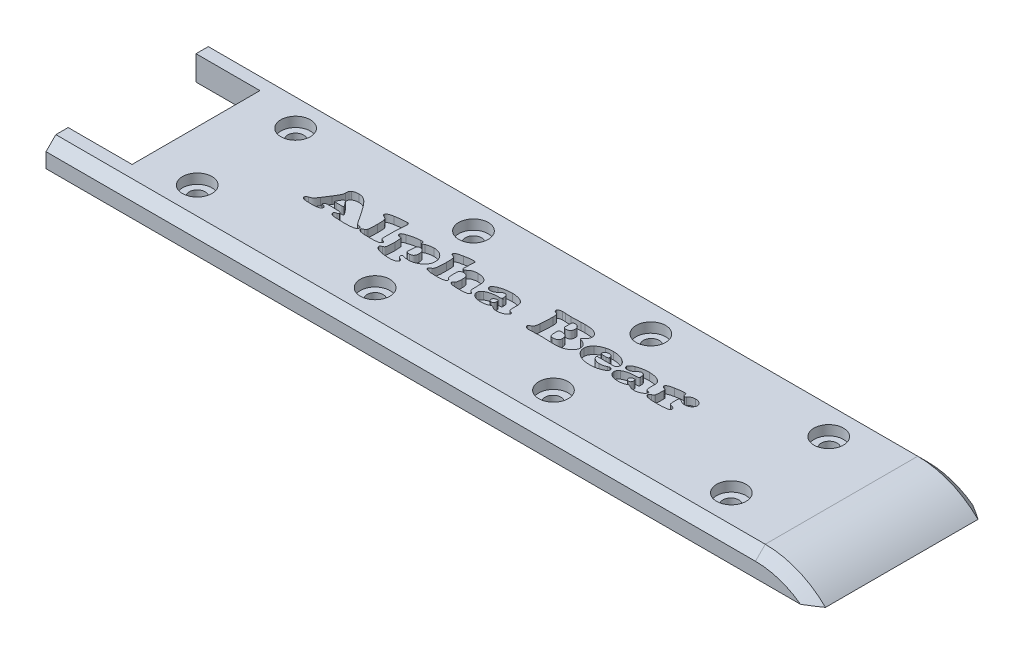
from build123d import *

# Parameters (mm, degrees)
BOSS_EXTRUDE1_DEPTH = 17.5
SKETCH2_W           = 18
SKETCH2_H           = 5
CUT_EXTRUDE1_DEPTH  = 17.5
SKETCH3_R           = 1.625
CUT_EXTRUDE2_DEPTH  = 5
SKETCH4_R           = 3
CUT_EXTRUDE3_DEPTH  = 2
CHAMFER1_SIZE       = 2
SKETCH5_W           = 13
SKETCH5_H           = 26
CUT_EXTRUDE4_DEPTH  = 5
CUT_EXTRUDE5_DEPTH  = 1.5


with BuildPart() as part:
    # Sketch1 → Boss-Extrude1 (new, symmetric)
    with BuildSketch(Plane.XY):
        with BuildLine():
            Line((-75, 17.5), (75, 17.5))
            ThreePointArc((75, 17.5), (81.614378278, 16.201851746), (87.247448714, 12.5))
            Line((87.247448714, 12.5), (-87.247448714, 12.5))
            ThreePointArc((-87.247448714, 12.5), (-81.614378278, 16.201851746), (-75, 17.5))
        make_face()
    extrude(amount=BOSS_EXTRUDE1_DEPTH, both=True)

    # Sketch2 → Cut-Extrude1 (cut, symmetric)
    with BuildSketch(Plane.XY):
        with Locations((-78.247448714, 15)):
            Rectangle(SKETCH2_W, SKETCH2_H)
    extrude(amount=CUT_EXTRUDE1_DEPTH, both=True, mode=Mode.SUBTRACT)

    # Sketch3 → Cut-Extrude2 (cut)
    with BuildSketch(Plane.XZ.offset(-12.5)):
        with Locations((-46, -10)):
            Circle(SKETCH3_R)
        with Locations((-9.833333333, -10)):
            Circle(SKETCH3_R)
        with Locations((26.333333333, -10)):
            Circle(SKETCH3_R)
        with Locations((62.5, -10)):
            Circle(SKETCH3_R)
    cut_extrude2 = extrude(amount=-CUT_EXTRUDE2_DEPTH, mode=Mode.SUBTRACT)

    # Sketch4 → Cut-Extrude3 (cut)
    with BuildSketch(Plane(origin=(0, 17.5, 0), x_dir=(1, 0, 0), z_dir=(0, 1, 0))):
        with Locations(Location((62.5, 9.9, 0), (0, 0, 180))):
            Circle(SKETCH4_R)
        with Locations(Location((26.333333333, 9.9, 0), (0, 0, 180))):
            Circle(SKETCH4_R)
        with Locations(Location((-9.833333333, 10, 0), (0, 0, 180))):
            Circle(SKETCH4_R)
        with Locations(Location((-46, 10, 0), (0, 0, 180))):
            Circle(SKETCH4_R)
    cut_extrude3 = extrude(amount=-CUT_EXTRUDE3_DEPTH, mode=Mode.SUBTRACT)

    # Mirror1: Cut-Extrude2, Cut-Extrude3 across plane
    add(cut_extrude2.mirror(Plane.XY), mode=Mode.SUBTRACT)
    add(cut_extrude3.mirror(Plane.XY), mode=Mode.SUBTRACT)

    # Chamfer1
    chamfer1_edges = [part.edges().sort_by_distance(p)[0] for p in [
        (81.614378278, 16.201851746, 17.5),
        (2.876275643, 17.5, 17.5),
        (2.876275643, 17.5, -17.5),
        (81.614378278, 16.201851746, -17.5),
    ]]
    chamfer(chamfer1_edges, length=CHAMFER1_SIZE)

    # Sketch5 → Cut-Extrude4 (cut)
    with BuildSketch(Plane(origin=(0, 17.5, 0), x_dir=(1, 0, 0), z_dir=(0, 1, 0))):
        with Locations((-62.747448714, 0)):
            Rectangle(SKETCH5_W, SKETCH5_H)
    extrude(amount=-CUT_EXTRUDE4_DEPTH, mode=Mode.SUBTRACT)

    # Sketch6 → Cut-Extrude5 (cut)
    # profile 1 of 9: a face of its own
    with BuildSketch(Plane(origin=(0, 17.5, 0), x_dir=(1, 0, 0), z_dir=(0, 1, 0))):
        with BuildLine():
            Line((-24.302496811, 1.6112033), (-23.060930953, -0.258152067))
            add(Edge.make_bspline(
                [(-23.060930953, -0.258152067), (-23.032862708, -0.298171266), (-22.981121929, -0.371942339), (-22.903649204, -0.469423441), (-22.835023937, -0.546161409), (-22.767958348, -0.602768629), (-22.69550855, -0.642860762), (-22.611752362, -0.673101336), (-22.512900288, -0.696399502), (-22.441651068, -0.706695967), (-22.403713812, -0.712178407)],
                knots=[0, 0, 0, 0, 1.402395681, 2.585164981, 3.571631095, 4.3525371, 5.090745612, 5.934788354, 6.900360388, 8, 8, 8, 8], degree=3))
            add(Edge.make_bspline(
                [(-22.403713812, -0.712178407), (-22.366693738, -0.717555354), (-22.297148229, -0.727656427), (-22.200360805, -0.752408398), (-22.118522361, -0.786242449), (-22.04897293, -0.826047305), (-21.99606738, -0.877520143), (-21.958325129, -0.937029632), (-21.934816742, -1.00428916), (-21.932604576, -1.052038646), (-21.931470364, -1.076520533)],
                knots=[0, 0, 0, 0, 1.358962194, 2.552931618, 3.61836542, 4.570259629, 5.446507482, 6.270566187, 7.113293019, 8, 8, 8, 8], degree=3))
            add(Edge.make_bspline(
                [(-21.931470364, -1.076520533), (-21.932777444, -1.105748258), (-21.935371917, -1.163763484), (-21.965935197, -1.246469934), (-22.011036115, -1.323749333), (-22.076087783, -1.393226327), (-22.159242282, -1.454848645), (-22.259181279, -1.510582953), (-22.377389171, -1.559515783), (-22.513941343, -1.602424713), (-22.671232404, -1.640299206), (-22.850531037, -1.671826788), (-23.052620515, -1.697756001), (-23.27740259, -1.719986772), (-23.525024428, -1.738187252), (-23.796045734, -1.750500783), (-24.089930539, -1.757104033), (-24.293618599, -1.758327336), (-24.399187606, -1.75896136)],
                knots=[0, 0, 0, 0, 0.509466697, 1.011259866, 1.524650627, 2.068784349, 2.664224166, 3.330749525, 4.067494936, 4.900388134, 5.834728675, 6.898406884, 8.086390056, 9.401556159, 10.853137667, 12.433399068, 14.151474773, 16, 16, 16, 16], degree=3))
            add(Edge.make_bspline(
                [(-24.399187606, -1.75896136), (-24.518766328, -1.758654012), (-24.74999094, -1.758059706), (-25.084953569, -1.754602801), (-25.395540429, -1.745140791), (-25.682456386, -1.736734603), (-25.944903025, -1.721729257), (-26.18422472, -1.707389845), (-26.399177296, -1.688073733), (-26.534362263, -1.671469907), (-26.5978522, -1.663671881)],
                knots=[0, 0, 0, 0, 1.303292942, 2.520125655, 3.650729085, 4.689893958, 5.64834543, 6.515616683, 7.302855891, 8, 8, 8, 8], degree=3))
            add(Edge.make_bspline(
                [(-26.5978522, -1.663671881), (-26.649968276, -1.655558925), (-26.749751889, -1.640025523), (-26.888818881, -1.598308067), (-27.012679738, -1.54896658), (-27.117936171, -1.486376593), (-27.2033769, -1.413956066), (-27.265789716, -1.332598083), (-27.305163725, -1.242827746), (-27.310065609, -1.179658921), (-27.312523292, -1.147987642)],
                knots=[0, 0, 0, 0, 1.320702206, 2.528671527, 3.631184344, 4.655361288, 5.585081728, 6.421154717, 7.208406213, 8, 8, 8, 8], degree=3))
            add(Edge.make_bspline(
                [(-27.312523292, -1.147987642), (-27.311906711, -1.123962281), (-27.310733608, -1.07825181), (-27.289172173, -1.014730552), (-27.259012797, -0.958532483), (-27.211630379, -0.910839875), (-27.147265879, -0.870769669), (-27.064831371, -0.831035964), (-26.960248409, -0.796207886), (-26.883343193, -0.774425823), (-26.841681161, -0.762625779)],
                knots=[0, 0, 0, 0, 0.861734551, 1.639529726, 2.393803198, 3.144305278, 4.031991716, 5.116894987, 6.438129191, 8, 8, 8, 8], degree=3))
            add(Edge.make_bspline(
                [(-26.841681161, -0.762625779), (-26.796508908, -0.749404757), (-26.716627223, -0.726024974), (-26.61966148, -0.673022929), (-26.550491233, -0.609939964), (-26.542654387, -0.556397098), (-26.538996934, -0.531408661)],
                knots=[0, 0, 0, 0, 1.38248073, 2.444750537, 3.274165599, 4, 4, 4, 4], degree=3))
            add(Edge.make_bspline(
                [(-26.538996934, -0.531408661), (-26.540484628, -0.508711327), (-26.543405948, -0.464141577), (-26.570663027, -0.401947089), (-26.61273752, -0.347003941), (-26.672254733, -0.299858723), (-26.74934558, -0.263404456), (-26.841157809, -0.23286458), (-26.949173051, -0.209007447), (-27.027008441, -0.199945898), (-27.068694332, -0.195092853)],
                knots=[0, 0, 0, 0, 0.786400453, 1.544219801, 2.321323414, 3.176933136, 4.158420228, 5.273998819, 6.540049901, 8, 8, 8, 8], degree=3))
            add(Edge.make_bspline(
                [(-27.068694332, -0.195092853), (-27.118672449, -0.191336424), (-27.223274676, -0.183474368), (-27.387141811, -0.171564308), (-27.565661817, -0.163868374), (-27.758577262, -0.156741456), (-27.966452566, -0.151362993), (-28.188792198, -0.146654707), (-28.425637308, -0.146209534), (-28.588188605, -0.145176725), (-28.671799683, -0.144645481)],
                knots=[0, 0, 0, 0, 0.749755514, 1.56920868, 2.457618336, 3.422534042, 4.457070239, 5.56828968, 6.749207628, 8, 8, 8, 8], degree=3))
            add(Edge.make_bspline(
                [(-28.671799683, -0.144645481), (-28.740463598, -0.145045882), (-28.870790557, -0.145805858), (-29.055340838, -0.147902801), (-29.218347299, -0.154041119), (-29.35952174, -0.160093782), (-29.478662143, -0.170114272), (-29.575990898, -0.180718151), (-29.651723625, -0.193350837), (-29.6939112, -0.206431489), (-29.711576056, -0.211908643)],
                knots=[0, 0, 0, 0, 1.577629629, 2.99440646, 4.240049792, 5.325301716, 6.240603521, 6.986066928, 7.575444138, 8, 8, 8, 8], degree=3))
            add(Edge.make_bspline(
                [(-29.711576056, -0.211908643), (-29.745713408, -0.229676677), (-29.817433409, -0.267005974), (-29.896743498, -0.360142744), (-29.960174763, -0.462096251), (-29.96935714, -0.538131617), (-29.973622123, -0.573448137)],
                knots=[0, 0, 0, 0, 0.978666331, 2.056104098, 3.097109124, 4, 4, 4, 4], degree=3))
            add(Edge.make_bspline(
                [(-29.973622123, -0.573448137), (-29.972050349, -0.593394084), (-29.969064815, -0.631280769), (-29.92480784, -0.665349094), (-29.870180792, -0.679565245), (-29.798181847, -0.699197114), (-29.69761829, -0.729877838), (-29.61966389, -0.749912354), (-29.575648417, -0.761224463)],
                knots=[0, 0, 0, 0, 0.735084733, 1.396269745, 1.963231215, 2.91143084, 4.256098034, 6, 6, 6, 6], degree=3))
            add(Edge.make_bspline(
                [(-29.575648417, -0.761224463), (-29.545542897, -0.769439651), (-29.488554017, -0.784990765), (-29.410734582, -0.817192079), (-29.345094425, -0.855294995), (-29.290413289, -0.899041323), (-29.247535003, -0.949823667), (-29.217864139, -1.007408226), (-29.198464706, -1.070142014), (-29.196763233, -1.114208358), (-29.195891817, -1.136777115)],
                knots=[0, 0, 0, 0, 1.287447417, 2.43710073, 3.465707359, 4.411434219, 5.315134362, 6.186358072, 7.071135905, 8, 8, 8, 8], degree=3))
            add(Edge.make_bspline(
                [(-29.195891817, -1.136777115), (-29.197026907, -1.16219891), (-29.199260806, -1.21222995), (-29.223587136, -1.283979192), (-29.260180014, -1.350788577), (-29.312376332, -1.411737518), (-29.377987082, -1.468382332), (-29.45836176, -1.519741499), (-29.55332479, -1.566180372), (-29.663149509, -1.605857629), (-29.78674331, -1.642109994), (-29.924205907, -1.674317588), (-30.076272835, -1.700764399), (-30.2428519, -1.72104783), (-30.424168496, -1.737786238), (-30.619939949, -1.750518944), (-30.830248474, -1.757066186), (-30.975092013, -1.758316292), (-31.049832709, -1.75896136)],
                knots=[0, 0, 0, 0, 0.576425673, 1.134427228, 1.705338623, 2.301420787, 2.949359092, 3.671667661, 4.465511462, 5.350027458, 6.325358055, 7.395311358, 8.560881316, 9.835751108, 11.212822562, 12.703965868, 14.299213845, 16, 16, 16, 16], degree=3))
            add(Edge.make_bspline(
                [(-31.049832709, -1.75896136), (-31.134851317, -1.758868291), (-31.298836693, -1.758688779), (-31.535660137, -1.752398311), (-31.75484669, -1.745063346), (-31.956526073, -1.731198635), (-32.141841178, -1.719086787), (-32.309442608, -1.698610943), (-32.459647132, -1.677195881), (-32.55304514, -1.65845537), (-32.596885426, -1.649658722)],
                knots=[0, 0, 0, 0, 1.313463763, 2.533431848, 3.660073328, 4.701309443, 5.65664683, 6.528527561, 7.309302492, 8, 8, 8, 8], degree=3))
            add(Edge.make_bspline(
                [(-32.596885426, -1.649658722), (-32.63263496, -1.640172549), (-32.700604728, -1.622136707), (-32.793850883, -1.584125116), (-32.873782771, -1.539497942), (-32.939938978, -1.486241043), (-32.98942354, -1.422694341), (-33.027481458, -1.353151263), (-33.048461962, -1.274355397), (-33.051006229, -1.219569182), (-33.052313082, -1.191428434)],
                knots=[0, 0, 0, 0, 1.257114306, 2.390122579, 3.414911136, 4.362920444, 5.256225619, 6.137581589, 7.043375261, 8, 8, 8, 8], degree=3))
            add(Edge.make_bspline(
                [(-33.052313082, -1.191428434), (-33.050833945, -1.167041251), (-33.048001333, -1.120338756), (-33.030094465, -1.053666968), (-32.997004679, -0.996981393), (-32.950745208, -0.94707313), (-32.885185236, -0.907499822), (-32.804432533, -0.866180653), (-32.701438475, -0.831231144), (-32.626392988, -0.809467284), (-32.585674899, -0.797658675)],
                knots=[0, 0, 0, 0, 0.877325395, 1.680115544, 2.455017511, 3.215406577, 4.100413917, 5.189449155, 6.475054711, 8, 8, 8, 8], degree=3))
            add(Edge.make_bspline(
                [(-32.585674899, -0.797658675), (-32.518515856, -0.777761326), (-32.391291614, -0.740068336), (-32.215297815, -0.669028555), (-32.066059885, -0.586127126), (-31.956617221, -0.507478885), (-31.877791918, -0.431595659), (-31.814452515, -0.361708753), (-31.743964639, -0.278809155), (-31.669042969, -0.181919612), (-31.586887176, -0.072271848), (-31.501096057, 0.052334577), (-31.408164085, 0.190154718), (-31.344919343, 0.286877092), (-31.311878776, 0.337407177)],
                knots=[0, 0, 0, 0, 1.430858851, 2.710579612, 3.868466806, 4.912671256, 5.452762666, 6.101232094, 6.839380196, 7.675661478, 8.603402048, 9.638669527, 10.766384419, 12, 12, 12, 12], degree=3))
            Line((-31.311878776, 0.337407177), (-30.385608988, 1.762545413))
            add(Edge.make_bspline(
                [(-30.385608988, 1.762545413), (-30.344437439, 1.826027522), (-30.265331431, 1.948000495), (-30.152151932, 2.124852833), (-30.051810658, 2.291133047), (-29.959093379, 2.443398292), (-29.879429365, 2.584682294), (-29.80831046, 2.711890073), (-29.749958982, 2.8283069), (-29.684781113, 2.964592008), (-29.61916521, 3.126313856), (-29.565144215, 3.319662745), (-29.527956829, 3.510480337), (-29.521417358, 3.63781168), (-29.518194467, 3.700565257)],
                knots=[0, 0, 0, 0, 1.266171967, 2.432791875, 3.513276011, 4.515980404, 5.415689951, 6.227286705, 6.954386681, 7.594240237, 8.755427079, 9.868828579, 10.949680202, 12, 12, 12, 12], degree=3))
            add(Edge.make_bspline(
                [(-29.518194467, 3.700565257), (-29.51631039, 3.761765873), (-29.512854455, 3.874025252), (-29.501899905, 4.027363436), (-29.481468084, 4.150320411), (-29.453889834, 4.249588714), (-29.409201012, 4.33287348), (-29.348158697, 4.410136928), (-29.266421479, 4.484304768), (-29.20384126, 4.529832721), (-29.170668132, 4.55396662)],
                knots=[0, 0, 0, 0, 1.508275986, 2.76660819, 3.782327277, 4.575767724, 5.291127205, 6.094350278, 6.989834725, 8, 8, 8, 8], degree=3))
            add(Edge.make_bspline(
                [(-29.170668132, 4.55396662), (-29.131867792, 4.579909682), (-29.053960937, 4.632000525), (-28.928009942, 4.697696685), (-28.795101122, 4.754127104), (-28.653496166, 4.798291698), (-28.504954123, 4.83549891), (-28.34786925, 4.860251955), (-28.183450229, 4.873856022), (-28.071593993, 4.87638275), (-28.014582542, 4.877670585)],
                knots=[0, 0, 0, 0, 0.917564191, 1.842368926, 2.789499357, 3.754249661, 4.757103552, 5.799423016, 6.878398824, 8, 8, 8, 8], degree=3))
            add(Edge.make_bspline(
                [(-28.014582542, 4.877670585), (-27.959428696, 4.876568025), (-27.849797766, 4.874376435), (-27.686186714, 4.857493387), (-27.525039269, 4.82704122), (-27.364420696, 4.788751965), (-27.206712221, 4.735973272), (-27.049896208, 4.674530824), (-26.895847887, 4.600370343), (-26.79647068, 4.542493995), (-26.746391682, 4.513328459)],
                knots=[0, 0, 0, 0, 0.990687, 1.969217871, 2.950120244, 3.935105401, 4.932803319, 5.934691266, 6.959232247, 8, 8, 8, 8], degree=3))
            add(Edge.make_bspline(
                [(-26.746391682, 4.513328459), (-26.710173244, 4.490351847), (-26.633871299, 4.441946663), (-26.519140836, 4.357895719), (-26.399934708, 4.257055133), (-26.274266212, 4.142454059), (-26.142327207, 4.0126736), (-26.00355938, 3.869104938), (-25.861360347, 3.708208811), (-25.711243372, 3.534962263), (-25.555194706, 3.34620971), (-25.393278096, 3.142715269), (-25.226997622, 2.922999872), (-25.051944037, 2.690713037), (-24.874539662, 2.440897065), (-24.686246137, 2.179439689), (-24.497111254, 1.899831207), (-24.368332913, 1.708843208), (-24.302496811, 1.6112033)],
                knots=[0, 0, 0, 0, 0.539497544, 1.13656781, 1.787375874, 2.502833881, 3.275735998, 4.115240342, 5.01413619, 5.976570974, 6.99905814, 8.094820255, 9.247781976, 10.465346557, 11.753683533, 13.102129739, 14.51850489, 16, 16, 16, 16], degree=3))
        make_face()
        with BuildLine():
            Line((-28.841358903, 1.02124932), (-27.626418047, 1.02124932))
            add(Edge.make_bspline(
                [(-27.626418047, 1.02124932), (-27.600249732, 1.021549158), (-27.55116873, 1.02211153), (-27.483033602, 1.025350042), (-27.42511067, 1.027754533), (-27.378819076, 1.037582474), (-27.341440322, 1.044633166), (-27.31509733, 1.055353619), (-27.295809955, 1.068092902), (-27.29284333, 1.080228995), (-27.291503554, 1.08570985)],
                knots=[0, 0, 0, 0, 1.771617414, 3.322826078, 4.623163417, 5.684098822, 6.528118706, 7.180208114, 7.629768842, 8, 8, 8, 8], degree=3))
            add(Edge.make_bspline(
                [(-27.291503554, 1.08570985), (-27.29379512, 1.100789386), (-27.299250091, 1.136685567), (-27.3243315, 1.19636005), (-27.363661832, 1.269617613), (-27.419341187, 1.356601104), (-27.489723482, 1.457340299), (-27.575369584, 1.572580249), (-27.678000666, 1.70054834), (-27.751530688, 1.790631282), (-27.790372003, 1.83821647)],
                knots=[0, 0, 0, 0, 0.401020674, 0.954612303, 1.692928573, 2.595119994, 3.674830949, 4.933663755, 6.380246225, 8, 8, 8, 8], degree=3))
            add(Edge.make_bspline(
                [(-27.790372003, 1.83821647), (-27.821557254, 1.880797339), (-27.878906826, 1.959103416), (-27.959112089, 2.065477776), (-28.03078368, 2.14652144), (-28.09103943, 2.208538282), (-28.146348775, 2.253694525), (-28.202473468, 2.283723881), (-28.259936533, 2.303154739), (-28.29937456, 2.305237204), (-28.318668085, 2.306255969)],
                knots=[0, 0, 0, 0, 1.733991977, 3.188805487, 4.373910566, 5.285325045, 6.028225182, 6.707899933, 7.367890152, 8, 8, 8, 8], degree=3))
            add(Edge.make_bspline(
                [(-28.318668085, 2.306255969), (-28.35315613, 2.302328747), (-28.424427685, 2.294212914), (-28.521449275, 2.22730344), (-28.604176307, 2.122854203), (-28.646903808, 2.0368498), (-28.670398367, 1.989558584)],
                knots=[0, 0, 0, 0, 0.822607651, 1.699966615, 2.735281294, 4, 4, 4, 4], degree=3))
            add(Edge.make_bspline(
                [(-28.670398367, 1.989558584), (-28.677017902, 1.977455331), (-28.695667433, 1.943356263), (-28.728073196, 1.875446545), (-28.77982188, 1.779197698), (-28.818168285, 1.704242132), (-28.839957587, 1.661650671)],
                knots=[0, 0, 0, 0, 0.448365357, 1.263201063, 2.444888434, 4, 4, 4, 4], degree=3))
            add(Edge.make_bspline(
                [(-28.839957587, 1.661650671), (-28.862457949, 1.624329839), (-28.905061269, 1.553664695), (-28.963844841, 1.453448966), (-29.013151324, 1.364548918), (-29.053828048, 1.288202272), (-29.085362793, 1.223227629), (-29.107120826, 1.170263351), (-29.123688435, 1.12962176), (-29.1262004, 1.105415181), (-29.12722734, 1.095519061)],
                knots=[0, 0, 0, 0, 1.640331725, 3.105886816, 4.373022776, 5.4662317, 6.362749501, 7.087680555, 7.62702605, 8, 8, 8, 8], degree=3))
            add(Edge.make_bspline(
                [(-29.12722734, 1.095519061), (-29.122192863, 1.083715035), (-29.109225599, 1.053311492), (-29.043594565, 1.035168889), (-28.955756867, 1.02210305), (-28.883302663, 1.021562338), (-28.841358903, 1.02124932)],
                knots=[0, 0, 0, 0, 0.476296284, 1.226792944, 2.394589586, 4, 4, 4, 4], degree=3))
        make_face(mode=Mode.SUBTRACT)
    # profile 2 of 9: a face of its own
    with BuildSketch(Plane(origin=(0, 17.5, 0), x_dir=(1, 0, 0), z_dir=(0, 1, 0))):
        with BuildLine():
            Line((-17.805996453, 2.082045431), (-17.805996453, 0.564420347))
            add(Edge.make_bspline(
                [(-17.805996453, 0.564420347), (-17.806318137, 0.485009913), (-17.806925578, 0.335058143), (-17.802917744, 0.12301071), (-17.801560191, -0.062949945), (-17.79511606, -0.222677531), (-17.789868417, -0.35580578), (-17.78416618, -0.463048279), (-17.773569985, -0.543660668), (-17.763597144, -0.617698449), (-17.726578867, -0.690982472), (-17.652232055, -0.759596747), (-17.549062462, -0.819011948), (-17.467992557, -0.846830412), (-17.423437221, -0.862119205)],
                knots=[0, 0, 0, 0, 1.771112662, 3.344415423, 4.73020728, 5.918625479, 6.909241851, 7.702745082, 8.311391976, 8.724199014, 9.362527757, 10.091883854, 10.951315481, 12, 12, 12, 12], degree=3))
            add(Edge.make_bspline(
                [(-17.423437221, -0.862119205), (-17.384495397, -0.873742188), (-17.312958665, -0.895093786), (-17.217566194, -0.931495794), (-17.142613551, -0.965808494), (-17.08590154, -0.999861303), (-17.045004703, -1.038186033), (-17.017552452, -1.083164702), (-17.002016751, -1.135317487), (-16.999929273, -1.172171368), (-16.998838514, -1.191428434)],
                knots=[0, 0, 0, 0, 1.672621805, 3.072632078, 4.199552978, 5.063861853, 5.784689524, 6.483901754, 7.207801147, 8, 8, 8, 8], degree=3))
            add(Edge.make_bspline(
                [(-16.998838514, -1.191428434), (-17.000607575, -1.217445827), (-17.004178202, -1.269958651), (-17.037994517, -1.344843421), (-17.090336653, -1.41455575), (-17.160663469, -1.479807489), (-17.247369548, -1.537951933), (-17.348540135, -1.58688874), (-17.462536409, -1.62811231), (-17.544617522, -1.645962167), (-17.587391178, -1.655263986)],
                knots=[0, 0, 0, 0, 0.771346844, 1.556866274, 2.402773044, 3.357462488, 4.399304289, 5.500572164, 6.697511985, 8, 8, 8, 8], degree=3))
            add(Edge.make_bspline(
                [(-17.587391178, -1.655263986), (-17.631700343, -1.663613563), (-17.727434957, -1.681653702), (-17.882346737, -1.701391332), (-18.058404489, -1.720343965), (-18.255304683, -1.732629473), (-18.473316949, -1.74700969), (-18.712646574, -1.751837167), (-18.973253767, -1.758857155), (-19.154055552, -1.758925741), (-19.24795048, -1.75896136)],
                knots=[0, 0, 0, 0, 0.649386541, 1.403067958, 2.248699616, 3.199838148, 4.244552937, 5.395662999, 6.647502103, 8, 8, 8, 8], degree=3))
            add(Edge.make_bspline(
                [(-19.24795048, -1.75896136), (-19.353983767, -1.758183896), (-19.557656503, -1.756690514), (-19.851081957, -1.752039369), (-20.119708654, -1.740586038), (-20.363621353, -1.725562374), (-20.582830072, -1.706266142), (-20.77771967, -1.682560431), (-20.948705658, -1.655970783), (-21.053425463, -1.631538649), (-21.101891371, -1.620231089)],
                knots=[0, 0, 0, 0, 1.366118697, 2.624092316, 3.780533676, 4.829740446, 5.772307381, 6.615029745, 7.359014843, 8, 8, 8, 8], degree=3))
            add(Edge.make_bspline(
                [(-21.101891371, -1.620231089), (-21.14136541, -1.60931588), (-21.217808299, -1.588178188), (-21.325443156, -1.544824257), (-21.420634487, -1.490929325), (-21.505353589, -1.431983467), (-21.572980918, -1.365670388), (-21.624502671, -1.297544509), (-21.656379523, -1.225791674), (-21.660440236, -1.176295296), (-21.662417718, -1.152191589)],
                knots=[0, 0, 0, 0, 1.262973306, 2.445793043, 3.568349197, 4.632109288, 5.620582952, 6.47665658, 7.258163452, 8, 8, 8, 8], degree=3))
            add(Edge.make_bspline(
                [(-21.662417718, -1.152191589), (-21.661291804, -1.134333273), (-21.659112901, -1.099773299), (-21.643658673, -1.050797102), (-21.616113581, -1.008517519), (-21.573871742, -0.972723454), (-21.515098186, -0.93861154), (-21.433070132, -0.904547337), (-21.327675852, -0.865390007), (-21.247801079, -0.841520811), (-21.20418743, -0.828487624)],
                knots=[0, 0, 0, 0, 0.707527272, 1.369228903, 2.011205195, 2.680121855, 3.543888047, 4.696402989, 6.196152318, 8, 8, 8, 8], degree=3))
            add(Edge.make_bspline(
                [(-21.20418743, -0.828487624), (-21.182865028, -0.820742003), (-21.140641946, -0.805403957), (-21.082790329, -0.770795673), (-21.030334696, -0.729240283), (-20.986083669, -0.676878733), (-20.948561161, -0.616178273), (-20.916184084, -0.547206231), (-20.890627915, -0.469105812), (-20.880283916, -0.413388199), (-20.874878201, -0.384270495)],
                knots=[0, 0, 0, 0, 0.929280988, 1.84018229, 2.753501919, 3.664403221, 4.637927977, 5.675789362, 6.785380852, 8, 8, 8, 8], degree=3))
            add(Edge.make_bspline(
                [(-20.874878201, -0.384270495), (-20.866141439, -0.329666423), (-20.847884138, -0.215559726), (-20.826001466, -0.035581484), (-20.806114414, 0.160589157), (-20.791030004, 0.373223925), (-20.780232984, 0.602187857), (-20.771977241, 0.847441114), (-20.765924386, 1.109502379), (-20.765694215, 1.289831132), (-20.765575563, 1.382788813)],
                knots=[0, 0, 0, 0, 0.748737047, 1.564643602, 2.45456671, 3.418488111, 4.450711762, 5.558245383, 6.741299743, 8, 8, 8, 8], degree=3))
            add(Edge.make_bspline(
                [(-20.765575563, 1.382788813), (-20.76588033, 1.475275112), (-20.766462191, 1.651850469), (-20.769830056, 1.904155917), (-20.779204191, 2.130656741), (-20.787597227, 2.331213171), (-20.801913529, 2.505475837), (-20.818029773, 2.653729759), (-20.837170821, 2.776379586), (-20.859488464, 2.876939126), (-20.888216445, 2.962446329), (-20.926653728, 3.038353265), (-20.973069828, 3.109026802), (-21.02877012, 3.174199991), (-21.092868113, 3.234973331), (-21.168561547, 3.287458071), (-21.250932489, 3.337307772), (-21.310836999, 3.364391829), (-21.341516385, 3.378262607)],
                knots=[0, 0, 0, 0, 1.999926971, 3.818271707, 5.455676618, 6.90177937, 8.1583091, 9.235802303, 10.125851757, 10.841278975, 11.460960026, 12.070766701, 12.67587086, 13.28500797, 13.921019522, 14.579724734, 15.272622832, 16, 16, 16, 16], degree=3))
            add(Edge.make_bspline(
                [(-21.341516385, 3.378262607), (-21.385700602, 3.396322), (-21.468183681, 3.430035267), (-21.57812814, 3.485627067), (-21.666489049, 3.538461695), (-21.734575488, 3.590850038), (-21.782336728, 3.647981704), (-21.817889514, 3.708062618), (-21.837583369, 3.77551246), (-21.840364849, 3.822362391), (-21.841786149, 3.846302107)],
                knots=[0, 0, 0, 0, 1.56500385, 2.921548528, 4.035571377, 4.939948913, 5.722600786, 6.463665788, 7.21495286, 8, 8, 8, 8], degree=3))
            add(Edge.make_bspline(
                [(-21.841786149, 3.846302107), (-21.838045078, 3.882288696), (-21.830249871, 3.957273338), (-21.759025762, 4.057984568), (-21.656948304, 4.152415504), (-21.540469699, 4.217103784), (-21.430060564, 4.268915795), (-21.33126953, 4.308112524), (-21.220404209, 4.345842348), (-21.097110236, 4.381478901), (-20.962770423, 4.418286376), (-20.816466354, 4.453173548), (-20.658075186, 4.486856352), (-20.5479583, 4.507064545), (-20.490917654, 4.517532407)],
                knots=[0, 0, 0, 0, 0.804119943, 1.675530988, 2.697215116, 3.93537666, 4.656777812, 5.45137874, 6.331289082, 7.298403992, 8.3466521, 9.473989788, 10.691524418, 12, 12, 12, 12], degree=3))
            add(Edge.make_bspline(
                [(-20.490917654, 4.517532407), (-20.40647936, 4.534921468), (-20.226511095, 4.57198379), (-19.937043742, 4.618649315), (-19.612640095, 4.662682234), (-19.32382713, 4.697743211), (-19.086891713, 4.723507936), (-18.917673393, 4.739495702), (-18.76140741, 4.756423142), (-18.617803031, 4.766172022), (-18.487167593, 4.77751671), (-18.369328799, 4.781998975), (-18.264268048, 4.787120622), (-18.198370415, 4.787710402), (-18.167535947, 4.787986369)],
                knots=[0, 0, 0, 0, 1.325262048, 2.824608388, 4.506426265, 6.358249772, 7.297207025, 8.170397985, 8.971418548, 9.713312483, 10.383055614, 10.986962098, 11.525984715, 12, 12, 12, 12], degree=3))
            add(Edge.make_bspline(
                [(-18.167535947, 4.787986369), (-18.12537065, 4.786965636), (-18.045500269, 4.785032143), (-17.934529802, 4.762296719), (-17.838794591, 4.727761852), (-17.759374635, 4.677121569), (-17.698854067, 4.60872427), (-17.656211314, 4.526432037), (-17.630721751, 4.43027109), (-17.6280405, 4.361683781), (-17.626628022, 4.325552133)],
                knots=[0, 0, 0, 0, 1.240925224, 2.350586323, 3.322196821, 4.227149897, 5.094897076, 5.981656158, 6.936740794, 8, 8, 8, 8], degree=3))
            add(Edge.make_bspline(
                [(-17.626628022, 4.325552133), (-17.627056398, 4.311070683), (-17.628037919, 4.277889874), (-17.630730408, 4.221786443), (-17.636541959, 4.153109195), (-17.645366121, 4.072387488), (-17.654707945, 3.979327468), (-17.668006242, 3.874360435), (-17.681428209, 3.75652098), (-17.692352125, 3.673923342), (-17.698095131, 3.630499463)],
                knots=[0, 0, 0, 0, 0.49744092, 1.139767884, 1.928250816, 2.863426982, 3.927881055, 5.139371115, 6.496087711, 8, 8, 8, 8], degree=3))
            add(Edge.make_bspline(
                [(-17.698095131, 3.630499463), (-17.712662766, 3.492757715), (-17.741179585, 3.223121852), (-17.77363774, 2.826955513), (-17.794614278, 2.448429542), (-17.802266499, 2.202109995), (-17.805996453, 2.082045431)],
                knots=[0, 0, 0, 0, 1.070447219, 2.095450085, 3.071657291, 4, 4, 4, 4], degree=3))
        make_face()
    # profile 3 of 9: a face of its own
    with BuildSketch(Plane(origin=(0, 17.5, 0), x_dir=(1, 0, 0), z_dir=(0, 1, 0))):
        with BuildLine():
            add(Edge.make_bspline(
                [(-13.54879885, 2.99430206), (-13.489490005, 2.993967024), (-13.383372811, 2.993367567), (-13.242077855, 2.98491763), (-13.138242582, 2.968680131), (-13.062423514, 2.94929132), (-13.012906877, 2.90767076), (-12.982345696, 2.849427904), (-12.965076425, 2.772936852), (-12.963769605, 2.716009819), (-12.963048818, 2.684611253)],
                knots=[0, 0, 0, 0, 1.819897649, 3.256216366, 4.330348118, 5.05530033, 5.614831544, 6.256405293, 7.038306248, 8, 8, 8, 8], degree=3))
            add(Edge.make_bspline(
                [(-12.963048818, 2.684611253), (-12.961848011, 2.657578762), (-12.959702559, 2.609280444), (-12.928538696, 2.546274024), (-12.873648878, 2.506565931), (-12.829667366, 2.503879578), (-12.806101441, 2.502440191)],
                knots=[0, 0, 0, 0, 1.176409723, 2.101863607, 2.982951318, 4, 4, 4, 4], degree=3))
            add(Edge.make_bspline(
                [(-12.806101441, 2.502440191), (-12.799060383, 2.503194858), (-12.781409167, 2.505086733), (-12.750660645, 2.514630617), (-12.709991251, 2.528532947), (-12.659933104, 2.548789085), (-12.598992001, 2.571877315), (-12.530079208, 2.603433537), (-12.450189403, 2.638322947), (-12.39450324, 2.664819057), (-12.364686943, 2.67900599)],
                knots=[0, 0, 0, 0, 0.355947057, 0.892323056, 1.613866486, 2.522423271, 3.610029072, 4.894922401, 6.337434058, 8, 8, 8, 8], degree=3))
            add(Edge.make_bspline(
                [(-12.364686943, 2.67900599), (-12.315026986, 2.70129594), (-12.210352491, 2.748279253), (-12.039171573, 2.805283421), (-11.849365045, 2.858760166), (-11.645306347, 2.904838672), (-11.436706867, 2.942934579), (-11.233587096, 2.973422693), (-11.040280441, 2.990659282), (-10.914821965, 2.993113567), (-10.854068439, 2.99430206)],
                knots=[0, 0, 0, 0, 0.840760035, 1.772174962, 2.784577676, 3.887819431, 5.003531306, 6.061170954, 7.061118031, 8, 8, 8, 8], degree=3))
            add(Edge.make_bspline(
                [(-10.854068439, 2.99430206), (-10.785371733, 2.992725501), (-10.649610824, 2.989609848), (-10.448607234, 2.971781399), (-10.253457838, 2.939164753), (-10.063791488, 2.894402793), (-9.879710116, 2.836873688), (-9.70137908, 2.76647964), (-9.528171157, 2.68422115), (-9.418188406, 2.619137242), (-9.363068357, 2.586519143)],
                knots=[0, 0, 0, 0, 1.052923066, 2.080824555, 3.089400214, 4.082590157, 5.065224021, 6.042287991, 7.018853572, 8, 8, 8, 8], degree=3))
            add(Edge.make_bspline(
                [(-9.363068357, 2.586519143), (-9.283057624, 2.533400201), (-9.125499183, 2.428797513), (-8.918250947, 2.239078157), (-8.733324231, 2.033845692), (-8.636462703, 1.879020857), (-8.588140682, 1.801782257)],
                knots=[0, 0, 0, 0, 1.033532714, 2.03524949, 3.019830515, 4, 4, 4, 4], degree=3))
            add(Edge.make_bspline(
                [(-8.588140682, 1.801782257), (-8.543894856, 1.718714497), (-8.456744913, 1.55509792), (-8.365378495, 1.294414197), (-8.310308926, 1.027318153), (-8.303086801, 0.846808519), (-8.299469614, 0.756400621)],
                knots=[0, 0, 0, 0, 1.028590549, 2.02599015, 3.011321014, 4, 4, 4, 4], degree=3))
            add(Edge.make_bspline(
                [(-8.299469614, 0.756400621), (-8.302503036, 0.660874156), (-8.308482696, 0.472566808), (-8.361861659, 0.19715304), (-8.449657045, -0.06450773), (-8.571298815, -0.314319372), (-8.729863494, -0.54950574), (-8.920670446, -0.773395537), (-9.148471574, -0.981378948), (-9.318819335, -1.105244952), (-9.406509148, -1.16900738)],
                knots=[0, 0, 0, 0, 0.988252585, 1.948101226, 2.891669758, 3.838985888, 4.815430059, 5.820449097, 6.878033904, 8, 8, 8, 8], degree=3))
            add(Edge.make_bspline(
                [(-9.406509148, -1.16900738), (-9.478135178, -1.216537596), (-9.620319477, -1.310889476), (-9.846844207, -1.429337746), (-10.078600622, -1.532233065), (-10.318700801, -1.615262941), (-10.565662478, -1.679546706), (-10.820367136, -1.726286142), (-11.082392925, -1.752623571), (-11.259460089, -1.756837036), (-11.34873294, -1.75896136)],
                knots=[0, 0, 0, 0, 0.999983911, 1.985060635, 2.971037247, 3.949429079, 4.938504018, 5.938842617, 6.960815821, 8, 8, 8, 8], degree=3))
            add(Edge.make_bspline(
                [(-11.34873294, -1.75896136), (-11.441817792, -1.757021576), (-11.630093374, -1.753098126), (-11.913732138, -1.713624043), (-12.202261536, -1.656341097), (-12.392653533, -1.598948578), (-12.489404055, -1.569783718)],
                knots=[0, 0, 0, 0, 0.961790844, 1.945340481, 2.955894242, 4, 4, 4, 4], degree=3))
            add(Edge.make_bspline(
                [(-12.489404055, -1.569783718), (-12.524161407, -1.558996185), (-12.585968, -1.539813462), (-12.650388498, -1.534342513), (-12.678581697, -1.531948189)],
                knots=[0, 0, 0, 0, 1.124713405, 2, 2, 2, 2], degree=3))
            add(Edge.make_bspline(
                [(-12.678581697, -1.531948189), (-12.694090641, -1.5326455), (-12.723364994, -1.533961728), (-12.764664182, -1.546880236), (-12.799078312, -1.56983128), (-12.826328257, -1.602219726), (-12.847395215, -1.64243553), (-12.862367589, -1.690846794), (-12.872522224, -1.747802102), (-12.873070396, -1.788804044), (-12.873364602, -1.810810047)],
                knots=[0, 0, 0, 0, 0.961823282, 1.815517165, 2.652768365, 3.496535237, 4.418553872, 5.45581849, 6.634521638, 8, 8, 8, 8], degree=3))
            add(Edge.make_bspline(
                [(-12.873364602, -1.810810047), (-12.872375953, -1.838004889), (-12.870446616, -1.891075239), (-12.852916311, -1.967011445), (-12.82625476, -2.038035852), (-12.786546896, -2.101990838), (-12.736535383, -2.161244742), (-12.673986741, -2.212254088), (-12.601924193, -2.259503314), (-12.548171191, -2.284220083), (-12.520233004, -2.297066652)],
                knots=[0, 0, 0, 0, 1.01607221, 1.982850606, 2.901348279, 3.842512096, 4.784649028, 5.789385009, 6.851030224, 8, 8, 8, 8], degree=3))
            add(Edge.make_bspline(
                [(-12.520233004, -2.297066652), (-12.47114922, -2.323120381), (-12.383284596, -2.369759024), (-12.267523276, -2.432784765), (-12.186943498, -2.484734033), (-12.13118507, -2.522873367), (-12.099013828, -2.563091367), (-12.078872989, -2.608777695), (-12.068640112, -2.66423212), (-12.067056437, -2.704345274), (-12.066206663, -2.725869308)],
                knots=[0, 0, 0, 0, 1.997649613, 3.575982067, 4.730872029, 5.449385787, 5.986831109, 6.557834955, 7.226158848, 8, 8, 8, 8], degree=3))
            add(Edge.make_bspline(
                [(-12.066206663, -2.725869308), (-12.067683159, -2.751188609), (-12.07059955, -2.80119958), (-12.090016595, -2.87438969), (-12.126993902, -2.940453888), (-12.17403027, -3.004214733), (-12.236177776, -3.062167031), (-12.311386519, -3.116137937), (-12.40126433, -3.16297376), (-12.502610565, -3.20765982), (-12.617002357, -3.246920477), (-12.742825685, -3.279436465), (-12.879607056, -3.309597057), (-13.027534233, -3.3326527), (-13.186472327, -3.351024284), (-13.356684907, -3.362905512), (-13.537961005, -3.371878152), (-13.662760249, -3.372802942), (-13.726765965, -3.373277238)],
                knots=[0, 0, 0, 0, 0.628595278, 1.241608491, 1.858662992, 2.49617195, 3.201229332, 3.957141426, 4.786935897, 5.710810502, 6.704199858, 7.783850814, 8.93423186, 10.178586206, 11.497016506, 12.903410519, 14.411853938, 16, 16, 16, 16], degree=3))
            add(Edge.make_bspline(
                [(-13.726765965, -3.373277238), (-13.842179664, -3.372027741), (-14.069465776, -3.369567085), (-14.40504686, -3.347233772), (-14.730300034, -3.315214266), (-15.044277776, -3.265102543), (-15.347653235, -3.204439545), (-15.639165923, -3.127905776), (-15.921243987, -3.041140793), (-16.101967277, -2.969050552), (-16.191680575, -2.933264056)],
                knots=[0, 0, 0, 0, 1.099104102, 2.164483949, 3.202137465, 4.210783292, 5.191481314, 6.147529708, 7.080410619, 8, 8, 8, 8], degree=3))
            add(Edge.make_bspline(
                [(-16.191680575, -2.933264056), (-16.234017988, -2.914747878), (-16.314484051, -2.879556215), (-16.424778704, -2.819474041), (-16.517827564, -2.755069617), (-16.594555255, -2.687777692), (-16.655293867, -2.617094227), (-16.697875271, -2.541923118), (-16.725104602, -2.462852702), (-16.72822152, -2.408449822), (-16.729785867, -2.381145604)],
                knots=[0, 0, 0, 0, 1.35699771, 2.579096214, 3.68293777, 4.674278013, 5.570253408, 6.405887023, 7.19993192, 8, 8, 8, 8], degree=3))
            add(Edge.make_bspline(
                [(-16.729785867, -2.381145604), (-16.728529239, -2.357280066), (-16.72614025, -2.311909062), (-16.713216984, -2.247592487), (-16.687278188, -2.193531394), (-16.65142869, -2.146065262), (-16.598462081, -2.106707434), (-16.530422568, -2.066019957), (-16.443887708, -2.024805813), (-16.379170207, -1.999539676), (-16.344424004, -1.98597453)],
                knots=[0, 0, 0, 0, 0.955896461, 1.817263918, 2.602951923, 3.335516519, 4.173043798, 5.220942536, 6.507950791, 8, 8, 8, 8], degree=3))
            add(Edge.make_bspline(
                [(-16.344424004, -1.98597453), (-16.293761794, -1.965813156), (-16.197731575, -1.92759727), (-16.076163372, -1.836655459), (-15.988613593, -1.720459152), (-15.945129775, -1.601421482), (-15.922210512, -1.483089092), (-15.908679663, -1.358773982), (-15.892992835, -1.200458547), (-15.877409625, -1.008499098), (-15.865994364, -0.781804704), (-15.852852639, -0.521669727), (-15.841933985, -0.227364357), (-15.836046283, -0.019933194), (-15.832943713, 0.089374268)],
                knots=[0, 0, 0, 0, 0.861334466, 1.632659473, 2.372882333, 3.134448996, 3.617866098, 4.281677225, 5.114715758, 6.139463346, 7.33308275, 8.711508104, 10.26710366, 12, 12, 12, 12], degree=3))
            add(Edge.make_bspline(
                [(-15.832943713, 0.089374268), (-15.837013339, 0.179065546), (-15.844666226, 0.347728988), (-15.857442924, 0.585009994), (-15.869385708, 0.791102737), (-15.883349341, 0.966283048), (-15.897708201, 1.110413937), (-15.915065039, 1.222824469), (-15.929327758, 1.305073158), (-15.944665013, 1.347862408), (-15.950654246, 1.364571707)],
                knots=[0, 0, 0, 0, 1.679097987, 3.157524954, 4.444078841, 5.539531295, 6.44442604, 7.151101241, 7.668503115, 8, 8, 8, 8], degree=3))
            add(Edge.make_bspline(
                [(-15.950654246, 1.364571707), (-15.960429029, 1.378241206), (-15.97981799, 1.405355606), (-16.022757816, 1.425737468), (-16.073771646, 1.435077997), (-16.140204798, 1.446061912), (-16.235018597, 1.46008984), (-16.307505941, 1.469779005), (-16.348627952, 1.475275661)],
                knots=[0, 0, 0, 0, 0.701807152, 1.392083127, 1.939361375, 2.902232843, 4.242639259, 6, 6, 6, 6], degree=3))
            add(Edge.make_bspline(
                [(-16.348627952, 1.475275661), (-16.381918697, 1.481181298), (-16.446494582, 1.492636788), (-16.538214676, 1.519666308), (-16.619180849, 1.559742228), (-16.689512572, 1.608442034), (-16.747511262, 1.665217979), (-16.789155024, 1.729312749), (-16.814740228, 1.799468316), (-16.817869285, 1.848278498), (-16.819470083, 1.873249367)],
                knots=[0, 0, 0, 0, 1.204384857, 2.336211382, 3.393121634, 4.408872351, 5.373862443, 6.264830414, 7.112302218, 8, 8, 8, 8], degree=3))
            add(Edge.make_bspline(
                [(-16.819470083, 1.873249367), (-16.817354589, 1.903474484), (-16.813119537, 1.963982788), (-16.776743982, 2.050651646), (-16.718816019, 2.130459257), (-16.636961985, 2.204939626), (-16.529312472, 2.273861124), (-16.396839992, 2.344703996), (-16.234488314, 2.410354183), (-16.116209767, 2.451178369), (-16.052950304, 2.473012558)],
                knots=[0, 0, 0, 0, 0.698349515, 1.398040722, 2.143170668, 2.970603204, 3.946576322, 5.099381953, 6.448649007, 8, 8, 8, 8], degree=3))
            add(Edge.make_bspline(
                [(-16.052950304, 2.473012558), (-15.925190868, 2.513924902), (-15.677169797, 2.593348575), (-15.312870264, 2.696627035), (-14.969270516, 2.784602819), (-14.647083517, 2.860970723), (-14.343686609, 2.916120083), (-14.061087366, 2.958742256), (-13.79834215, 2.987455598), (-13.629672316, 2.992083218), (-13.54879885, 2.99430206)],
                knots=[0, 0, 0, 0, 1.254403972, 2.435190912, 3.540169305, 4.571141229, 5.530674012, 6.42269077, 7.243715003, 8, 8, 8, 8], degree=3))
        make_face()
        with BuildLine():
            Line((-12.85374618, 1.202019067), (-12.956042239, -0.108211269))
            add(Edge.make_bspline(
                [(-12.956042239, -0.108211269), (-12.958261127, -0.13435353), (-12.962693619, -0.186575775), (-12.962930512, -0.238985189), (-12.963048818, -0.265158646)],
                knots=[0, 0, 0, 0, 1.00119256, 2, 2, 2, 2], degree=3))
            add(Edge.make_bspline(
                [(-12.963048818, -0.265158646), (-12.961046189, -0.28900068), (-12.957007623, -0.337081298), (-12.917677062, -0.402862205), (-12.85773275, -0.459605334), (-12.776712456, -0.507946217), (-12.677093485, -0.546147971), (-12.561160121, -0.573607332), (-12.430097243, -0.590287828), (-12.337648228, -0.592108699), (-12.289015886, -0.593066559)],
                knots=[0, 0, 0, 0, 0.692628648, 1.39677734, 2.180287361, 3.095220651, 4.139193984, 5.293719127, 6.576374476, 8, 8, 8, 8], degree=3))
            add(Edge.make_bspline(
                [(-12.289015886, -0.593066559), (-12.251143714, -0.592307878), (-12.177513384, -0.590832865), (-12.07058381, -0.578035784), (-11.970618884, -0.557197413), (-11.87786632, -0.52815255), (-11.79286431, -0.489830652), (-11.714703798, -0.443523023), (-11.644946635, -0.387344441), (-11.582455398, -0.322944966), (-11.526004248, -0.251729564), (-11.478086379, -0.171095646), (-11.439249832, -0.081222623), (-11.405243684, 0.015962711), (-11.381172173, 0.122377281), (-11.360065424, 0.236223721), (-11.351980779, 0.359252172), (-11.349834376, 0.443906996), (-11.34873294, 0.487347975)],
                knots=[0, 0, 0, 0, 1.107408859, 2.153002469, 3.144440869, 4.090700184, 4.989616165, 5.865925529, 6.740742575, 7.600602542, 8.486129219, 9.392901561, 10.334811144, 11.345824816, 12.399598364, 13.522656577, 14.728740828, 16, 16, 16, 16], degree=3))
            add(Edge.make_bspline(
                [(-11.34873294, 0.487347975), (-11.34945433, 0.543472297), (-11.35084792, 0.651893869), (-11.371487368, 0.807927404), (-11.401547662, 0.951144589), (-11.443436619, 1.082339911), (-11.499237778, 1.200389995), (-11.568448284, 1.304828452), (-11.649305651, 1.396886277), (-11.712267257, 1.44719437), (-11.743904014, 1.472473029)],
                knots=[0, 0, 0, 0, 1.220330898, 2.357448406, 3.417993836, 4.401520012, 5.347133905, 6.249194358, 7.120260474, 8, 8, 8, 8], degree=3))
            add(Edge.make_bspline(
                [(-11.743904014, 1.472473029), (-11.78609865, 1.499598382), (-11.870691261, 1.553979809), (-12.013400618, 1.610287773), (-12.167973854, 1.642593224), (-12.274845721, 1.646853818), (-12.329654046, 1.649038828)],
                knots=[0, 0, 0, 0, 0.966596879, 1.937851881, 2.942444921, 4, 4, 4, 4], degree=3))
            add(Edge.make_bspline(
                [(-12.329654046, 1.649038828), (-12.367586089, 1.647809351), (-12.439894015, 1.645465663), (-12.541514885, 1.6249276), (-12.629570568, 1.589400227), (-12.704258709, 1.539938421), (-12.764123715, 1.475262025), (-12.810217701, 1.397086432), (-12.840957243, 1.304402588), (-12.849341473, 1.237281527), (-12.85374618, 1.202019067)],
                knots=[0, 0, 0, 0, 1.175707898, 2.241192218, 3.196258326, 4.104349776, 4.996115704, 5.905477455, 6.899629746, 8, 8, 8, 8], degree=3))
        make_face(mode=Mode.SUBTRACT)
    # profile 4 of 9: a face of its own
    with BuildSketch(Plane(origin=(0, 17.5, 0), x_dir=(1, 0, 0), z_dir=(0, 1, 0))):
        with BuildLine():
            Line((-4.173995702, 4.548361356), (-4.263679918, 2.543078351))
            add(Edge.make_bspline(
                [(-4.263679918, 2.543078351), (-4.264161743, 2.514991836), (-4.265067301, 2.462205211), (-4.252118816, 2.388408057), (-4.230469798, 2.324784341), (-4.195933324, 2.272945761), (-4.151202953, 2.232323422), (-4.096151441, 2.204001431), (-4.03113127, 2.186922767), (-3.98446609, 2.185238939), (-3.959594375, 2.184341489)],
                knots=[0, 0, 0, 0, 1.239505081, 2.329562438, 3.296630466, 4.190326176, 5.053174513, 5.940161419, 6.902142491, 8, 8, 8, 8], degree=3))
            add(Edge.make_bspline(
                [(-3.959594375, 2.184341489), (-3.933160816, 2.18630456), (-3.878714208, 2.190348002), (-3.799441866, 2.222522478), (-3.720623919, 2.270644808), (-3.674332331, 2.315051932), (-3.649903568, 2.338486234)],
                knots=[0, 0, 0, 0, 0.891722714, 1.836728746, 2.858409458, 4, 4, 4, 4], degree=3))
            add(Edge.make_bspline(
                [(-3.649903568, 2.338486234), (-3.595493244, 2.391223821), (-3.487292519, 2.49609813), (-3.304691148, 2.628833148), (-3.109783843, 2.74195223), (-2.901744989, 2.834719194), (-2.679850397, 2.906139537), (-2.445323822, 2.957791095), (-2.197133378, 2.989334878), (-2.027274717, 2.992619938), (-1.940298211, 2.99430206)],
                knots=[0, 0, 0, 0, 0.964995399, 1.918996132, 2.868862053, 3.833839079, 4.816837604, 5.835410067, 6.891616899, 8, 8, 8, 8], degree=3))
            add(Edge.make_bspline(
                [(-1.940298211, 2.99430206), (-1.855247856, 2.992974123), (-1.689080222, 2.990379657), (-1.445970649, 2.969649613), (-1.2163628, 2.932657915), (-0.999358305, 2.884983785), (-0.797329883, 2.819689224), (-0.60781171, 2.742925439), (-0.431524547, 2.650678592), (-0.323450566, 2.576841598), (-0.269929698, 2.540275719)],
                knots=[0, 0, 0, 0, 1.159909691, 2.266180432, 3.32402801, 4.330138998, 5.29319395, 6.215982194, 7.11651092, 8, 8, 8, 8], degree=3))
            add(Edge.make_bspline(
                [(-0.269929698, 2.540275719), (-0.226517383, 2.506282521), (-0.141962344, 2.440073284), (-0.032466674, 2.32498117), (0.05642179, 2.199980734), (0.12612161, 2.061521255), (0.178438427, 1.903417174), (0.216615498, 1.719168702), (0.240592555, 1.50525273), (0.247625426, 1.352953895), (0.251359805, 1.27208486)],
                knots=[0, 0, 0, 0, 0.924366292, 1.800406838, 2.655146614, 3.489478374, 4.391778311, 5.441839771, 6.641644572, 8, 8, 8, 8], degree=3))
            Line((0.251359805, 1.27208486), (0.310215071, -0.416500759))
            add(Edge.make_bspline(
                [(0.310215071, -0.416500759), (0.312447714, -0.450645856), (0.316629735, -0.514603916), (0.330965135, -0.603967148), (0.35569375, -0.67896681), (0.391673471, -0.743855021), (0.447591068, -0.801469792), (0.524904656, -0.860929135), (0.626287399, -0.928000132), (0.703691948, -0.972376307), (0.746024305, -0.996645528)],
                knots=[0, 0, 0, 0, 1.056505209, 1.978967101, 2.786326633, 3.48406838, 4.249630089, 5.245306532, 6.493464914, 8, 8, 8, 8], degree=3))
            add(Edge.make_bspline(
                [(0.746024305, -0.996645528), (0.774895354, -1.014173139), (0.82839807, -1.046654634), (0.891341321, -1.109032715), (0.929756509, -1.179310141), (0.935295883, -1.228857966), (0.938004579, -1.253086332)],
                knots=[0, 0, 0, 0, 1.204150125, 2.231484702, 3.135214598, 4, 4, 4, 4], degree=3))
            add(Edge.make_bspline(
                [(0.938004579, -1.253086332), (0.936304623, -1.273869164), (0.932905571, -1.315424287), (0.907331258, -1.375103481), (0.86496054, -1.429277688), (0.805889048, -1.478550136), (0.730406875, -1.522481058), (0.640483024, -1.564568629), (0.534359405, -1.602112184), (0.412042257, -1.635301192), (0.273043734, -1.664513273), (0.117618459, -1.688719116), (-0.053679372, -1.712129389), (-0.24178129, -1.727464682), (-0.445868002, -1.74215525), (-0.666452146, -1.750983405), (-0.902799545, -1.759054224), (-1.065868776, -1.758992954), (-1.149956062, -1.75896136)],
                knots=[0, 0, 0, 0, 0.439440199, 0.878657502, 1.351688314, 1.885138822, 2.497793476, 3.197244874, 3.98605038, 4.879133482, 5.880605256, 6.993376117, 8.210989086, 9.54231877, 10.9904753, 12.545642976, 14.218747303, 16, 16, 16, 16], degree=3))
            add(Edge.make_bspline(
                [(-1.149956062, -1.75896136), (-1.225163011, -1.758807712), (-1.370462103, -1.758510865), (-1.581190282, -1.752988468), (-1.776912201, -1.742917681), (-1.958270727, -1.730848794), (-2.12516373, -1.714297762), (-2.277436116, -1.693109931), (-2.415580935, -1.67001755), (-2.538903957, -1.641726327), (-2.648739507, -1.611565143), (-2.744268261, -1.577201068), (-2.82459047, -1.53808994), (-2.890687354, -1.49606012), (-2.942616081, -1.449550181), (-2.979603925, -1.398442004), (-3.004573417, -1.343502409), (-3.006924383, -1.304723253), (-3.008100901, -1.285316597)],
                knots=[0, 0, 0, 0, 1.779557199, 3.438087149, 4.9874314, 6.416726182, 7.738696274, 8.954820761, 10.054185247, 11.051647756, 11.94741313, 12.748198232, 13.450125008, 14.057131544, 14.596917884, 15.087747946, 15.543472218, 16, 16, 16, 16], degree=3))
            add(Edge.make_bspline(
                [(-3.008100901, -1.285316597), (-3.006851842, -1.26171877), (-3.004592831, -1.219040447), (-2.981646298, -1.166212024), (-2.942591108, -1.127441564), (-2.895817819, -1.080014327), (-2.827670945, -1.015408845), (-2.775516451, -0.966704331), (-2.746054834, -0.939191578)],
                knots=[0, 0, 0, 0, 0.943410448, 1.70622386, 2.236757884, 3.13754045, 4.383021693, 6, 6, 6, 6], degree=3))
            add(Edge.make_bspline(
                [(-2.746054834, -0.939191578), (-2.723491132, -0.914284872), (-2.675007759, -0.860767009), (-2.620682133, -0.75657751), (-2.573490122, -0.630917856), (-2.534452032, -0.481101135), (-2.50693228, -0.306897667), (-2.483960933, -0.109204463), (-2.472276676, 0.112590098), (-2.470781049, 0.268265037), (-2.469995608, 0.35001902)],
                knots=[0, 0, 0, 0, 0.597551678, 1.283979041, 2.077983307, 2.99168389, 4.039810448, 5.222440887, 6.541341853, 8, 8, 8, 8], degree=3))
            add(Edge.make_bspline(
                [(-2.469995608, 0.35001902), (-2.47051058, 0.400009692), (-2.471507614, 0.496796464), (-2.479797545, 0.637106058), (-2.494123832, 0.76698654), (-2.511130702, 0.886655991), (-2.536665048, 0.995243974), (-2.567553062, 1.092908556), (-2.601500852, 1.181696886), (-2.631869592, 1.234114417), (-2.646561408, 1.259473017)],
                knots=[0, 0, 0, 0, 1.280367083, 2.478914434, 3.597976253, 4.626737492, 5.572798372, 6.450662687, 7.250460196, 8, 8, 8, 8], degree=3))
            add(Edge.make_bspline(
                [(-2.646561408, 1.259473017), (-2.667278248, 1.290394403), (-2.708244354, 1.351539285), (-2.782946975, 1.433088265), (-2.872462465, 1.499042446), (-2.971201454, 1.555597066), (-3.083090565, 1.597419599), (-3.205223548, 1.62811308), (-3.339195372, 1.646418772), (-3.432174327, 1.648144679), (-3.480344348, 1.649038828)],
                knots=[0, 0, 0, 0, 0.924552395, 1.828237836, 2.73155027, 3.677720744, 4.648017918, 5.689931024, 6.80321229, 8, 8, 8, 8], degree=3))
            add(Edge.make_bspline(
                [(-3.480344348, 1.649038828), (-3.547403453, 1.647102053), (-3.673958035, 1.643446953), (-3.849324459, 1.603937476), (-4.000018519, 1.541414877), (-4.0777181, 1.475022068), (-4.115140436, 1.443045396)],
                knots=[0, 0, 0, 0, 1.174403572, 2.216345625, 3.140941144, 4, 4, 4, 4], degree=3))
            add(Edge.make_bspline(
                [(-4.115140436, 1.443045396), (-4.138400354, 1.41368986), (-4.189386559, 1.349341939), (-4.231387715, 1.21909181), (-4.259281889, 1.060380797), (-4.262128832, 0.9434327), (-4.263679918, 0.879716417)],
                knots=[0, 0, 0, 0, 0.750339752, 1.644759696, 2.716805475, 4, 4, 4, 4], degree=3))
            Line((-4.263679918, 0.879716417), (-4.263679918, -0.024132317))
            add(Edge.make_bspline(
                [(-4.263679918, -0.024132317), (-4.259441638, -0.071306944), (-4.251426747, -0.16051755), (-4.240653485, -0.286252083), (-4.229718482, -0.395600229), (-4.217964828, -0.488449558), (-4.208800245, -0.565182871), (-4.199316788, -0.62608908), (-4.189503668, -0.670302422), (-4.178383483, -0.714194355), (-4.139705087, -0.762115841), (-4.073711929, -0.825748515), (-3.977911421, -0.908671963), (-3.901581648, -0.966794792), (-3.858699632, -0.99944816)],
                knots=[0, 0, 0, 0, 1.516765359, 2.868312193, 4.041173155, 5.035640979, 5.864978918, 6.516648884, 7.006630135, 7.318966712, 7.95376604, 8.926854744, 10.27350901, 12, 12, 12, 12], degree=3))
            add(Edge.make_bspline(
                [(-3.858699632, -0.99944816), (-3.838080398, -1.01528919), (-3.799045146, -1.045278596), (-3.758433499, -1.10340715), (-3.730016145, -1.164185714), (-3.727062563, -1.207462335), (-3.725574625, -1.229263962)],
                knots=[0, 0, 0, 0, 1.124288777, 2.128444464, 3.057159356, 4, 4, 4, 4], degree=3))
            add(Edge.make_bspline(
                [(-3.725574625, -1.229263962), (-3.726666846, -1.250996612), (-3.728850524, -1.294446681), (-3.754707773, -1.355716745), (-3.79413572, -1.412157652), (-3.848392674, -1.463697913), (-3.917104507, -1.51214449), (-4.001637131, -1.554356601), (-4.100511442, -1.593820571), (-4.215151933, -1.628145631), (-4.344058283, -1.660344519), (-4.488772548, -1.686556738), (-4.648202396, -1.708822289), (-4.823111073, -1.726112256), (-5.012679416, -1.742584451), (-5.217463558, -1.750854451), (-5.437450807, -1.759100848), (-5.589314908, -1.759008886), (-5.667798416, -1.75896136)],
                knots=[0, 0, 0, 0, 0.484973811, 0.969607727, 1.466773489, 2.022671116, 2.639192299, 3.347040267, 4.137240199, 5.025732277, 6.029848492, 7.117317705, 8.32388255, 9.641095587, 11.060743499, 12.592752801, 14.239131482, 16, 16, 16, 16], degree=3))
            add(Edge.make_bspline(
                [(-5.667798416, -1.75896136), (-5.759351843, -1.758180489), (-5.936869217, -1.756666422), (-6.194332554, -1.751961922), (-6.434477642, -1.740560833), (-6.656330807, -1.724875434), (-6.860751791, -1.707816861), (-7.047098168, -1.683380348), (-7.216288299, -1.656958828), (-7.367306823, -1.621967286), (-7.501310851, -1.587337064), (-7.617368365, -1.546202435), (-7.716570899, -1.502648157), (-7.796787263, -1.452017209), (-7.86121067, -1.398420029), (-7.906703415, -1.339222555), (-7.936474565, -1.274816825), (-7.939308975, -1.229570811), (-7.940732752, -1.206842908)],
                knots=[0, 0, 0, 0, 1.781258891, 3.45376913, 5.009445402, 6.45782474, 7.780809465, 8.999291282, 10.113808342, 11.110339558, 12.014177188, 12.804587925, 13.504036661, 14.116690711, 14.645022466, 15.124860589, 15.560401407, 16, 16, 16, 16], degree=3))
            add(Edge.make_bspline(
                [(-7.940732752, -1.206842908), (-7.940157198, -1.186665183), (-7.939069876, -1.148545897), (-7.924723096, -1.094890844), (-7.900403628, -1.049190298), (-7.864362012, -1.006740097), (-7.807538932, -0.967103935), (-7.728423442, -0.919960902), (-7.623041496, -0.862752804), (-7.543350443, -0.822630391), (-7.499318254, -0.800461307)],
                knots=[0, 0, 0, 0, 0.756102282, 1.428410766, 2.064019794, 2.686173961, 3.500090192, 4.649268847, 6.148599872, 8, 8, 8, 8], degree=3))
            add(Edge.make_bspline(
                [(-7.499318254, -0.800461307), (-7.478248331, -0.788603193), (-7.43463787, -0.764059305), (-7.376983784, -0.710665404), (-7.325659781, -0.643568799), (-7.277000652, -0.564876695), (-7.237839342, -0.4704847), (-7.199579988, -0.364690712), (-7.167597337, -0.2446396), (-7.141629645, -0.109622172), (-7.117190146, 0.043091636), (-7.098506017, 0.217606332), (-7.081820926, 0.414778535), (-7.068046549, 0.634846837), (-7.05705838, 0.877777949), (-7.048410407, 1.143574318), (-7.044730326, 1.432758362), (-7.044177796, 1.633156741), (-7.043890597, 1.737321728)],
                knots=[0, 0, 0, 0, 0.435846808, 0.902114349, 1.407130691, 1.960245288, 2.568886873, 3.249826978, 3.993270809, 4.811218514, 5.734265318, 6.787820921, 7.982555753, 9.310757635, 10.772918707, 12.377845776, 14.117242038, 16, 16, 16, 16], degree=3))
            add(Edge.make_bspline(
                [(-7.043890597, 1.737321728), (-7.044075776, 1.818602126), (-7.044431261, 1.974635024), (-7.049421894, 2.198828375), (-7.053613916, 2.403999287), (-7.064506935, 2.589367026), (-7.074264003, 2.755893195), (-7.090465152, 2.901987407), (-7.106102531, 3.02937241), (-7.121049946, 3.106935348), (-7.127969549, 3.142841542)],
                knots=[0, 0, 0, 0, 1.383481083, 2.655850186, 3.817118543, 4.876053122, 5.816414138, 6.655828361, 7.377742914, 8, 8, 8, 8], degree=3))
            add(Edge.make_bspline(
                [(-7.127969549, 3.142841542), (-7.133057066, 3.165849131), (-7.142677081, 3.209354316), (-7.164207407, 3.269267254), (-7.194874491, 3.317485727), (-7.230003869, 3.360026522), (-7.278041203, 3.395723215), (-7.339214018, 3.430710667), (-7.41682601, 3.465392545), (-7.474864598, 3.486132314), (-7.506324833, 3.497374456)],
                knots=[0, 0, 0, 0, 1.023006426, 1.934408794, 2.744785458, 3.492617247, 4.316081586, 5.32471724, 6.549843645, 8, 8, 8, 8], degree=3))
            add(Edge.make_bspline(
                [(-7.506324833, 3.497374456), (-7.540527199, 3.510164054), (-7.604888283, 3.534231173), (-7.694333454, 3.572606748), (-7.768289402, 3.614985897), (-7.830514265, 3.656750074), (-7.878486582, 3.701931058), (-7.914699091, 3.747475666), (-7.936363973, 3.796447473), (-7.93928321, 3.829760557), (-7.940732752, 3.846302107)],
                knots=[0, 0, 0, 0, 1.490126121, 2.804078837, 3.964790227, 4.964061034, 5.853925933, 6.642969964, 7.326169234, 8, 8, 8, 8], degree=3))
            add(Edge.make_bspline(
                [(-7.940732752, 3.846302107), (-7.936885905, 3.884890107), (-7.929120856, 3.962781887), (-7.865369664, 4.070438063), (-7.76284331, 4.160931057), (-7.650841961, 4.224599183), (-7.539691574, 4.27234348), (-7.435323645, 4.310146195), (-7.312972877, 4.34734657), (-7.172770651, 4.386455338), (-7.014961926, 4.427102026), (-6.839077729, 4.467251494), (-6.646309585, 4.50960998), (-6.511448082, 4.536026827), (-6.441324775, 4.549762672)],
                knots=[0, 0, 0, 0, 0.787204194, 1.589010465, 2.490278071, 3.5677178, 4.215324063, 4.969688719, 5.842051553, 6.836541459, 7.953763518, 9.182629424, 10.535064956, 12, 12, 12, 12], degree=3))
            add(Edge.make_bspline(
                [(-6.441324775, 4.549762672), (-6.344719883, 4.568914102), (-6.156963849, 4.606135783), (-5.881912211, 4.652665894), (-5.622520068, 4.695967359), (-5.377654631, 4.729547115), (-5.147703669, 4.754711588), (-4.933252837, 4.773070387), (-4.733721117, 4.785019107), (-4.605615694, 4.787022091), (-4.543943091, 4.787986369)],
                knots=[0, 0, 0, 0, 1.23417712, 2.398679804, 3.495801138, 4.529825451, 5.495632908, 6.394509302, 7.227083535, 8, 8, 8, 8], degree=3))
            add(Edge.make_bspline(
                [(-4.543943091, 4.787986369), (-4.513993178, 4.787225953), (-4.458062738, 4.785805901), (-4.380149543, 4.77436898), (-4.313568208, 4.757880659), (-4.260171213, 4.730210758), (-4.217623957, 4.697099284), (-4.189838795, 4.653527657), (-4.173739202, 4.603211576), (-4.173907741, 4.567171107), (-4.173995702, 4.548361356)],
                knots=[0, 0, 0, 0, 1.427519881, 2.66584459, 3.752349041, 4.679069255, 5.517776722, 6.290239957, 7.107665331, 8, 8, 8, 8], degree=3))
        make_face()
    # profile 5 of 9: a face of its own
    with BuildSketch(Plane(origin=(0, 17.5, 0), x_dir=(1, 0, 0), z_dir=(0, 1, 0))):
        with BuildLine():
            add(Edge.make_bspline(
                [(5.076090333, 2.99430206), (5.169534814, 2.992738204), (5.352863304, 2.989670079), (5.622404435, 2.972032216), (5.881010705, 2.939417449), (6.129065012, 2.895031748), (6.366348017, 2.837555878), (6.592791954, 2.767904867), (6.807876508, 2.683609113), (6.944892499, 2.617726547), (7.012708861, 2.585117827)],
                knots=[0, 0, 0, 0, 1.122611011, 2.202447689, 3.242962201, 4.252263671, 5.228081799, 6.17406474, 7.09624937, 8, 8, 8, 8], degree=3))
            add(Edge.make_bspline(
                [(7.012708861, 2.585117827), (7.078135636, 2.548813511), (7.202849636, 2.47961162), (7.36626884, 2.356680171), (7.501136634, 2.228050881), (7.604520215, 2.085644895), (7.681328588, 1.925869089), (7.730810428, 1.742561573), (7.764221993, 1.534414511), (7.766704653, 1.386679065), (7.768018113, 1.308519072)],
                knots=[0, 0, 0, 0, 1.13305406, 2.15978404, 3.091130553, 3.94803605, 4.81263061, 5.762896406, 6.816451941, 8, 8, 8, 8], degree=3))
            Line((7.768018113, 1.308519072), (7.754004955, 0.614867718))
            add(Edge.make_bspline(
                [(7.754004955, 0.614867718), (7.754586534, 0.55740414), (7.755698139, 0.447570809), (7.762797749, 0.291026601), (7.773111612, 0.150159439), (7.790225066, 0.025380077), (7.810186146, -0.084531999), (7.836729145, -0.178200975), (7.86642091, -0.257007247), (7.893069621, -0.300961103), (7.905347068, -0.321211281)],
                knots=[0, 0, 0, 0, 1.438435591, 2.749361864, 3.922402935, 4.972501561, 5.901271538, 6.715598423, 7.408257594, 8, 8, 8, 8], degree=3))
            add(Edge.make_bspline(
                [(7.905347068, -0.321211281), (7.928555901, -0.35063497), (7.969132538, -0.402077211), (8.037021007, -0.449958399), (8.100020679, -0.467714459), (8.163400515, -0.479540734), (8.245209943, -0.492195405), (8.306095901, -0.499399669), (8.339754987, -0.503382343)],
                knots=[0, 0, 0, 0, 1.369902347, 2.395037682, 2.968728145, 3.754006555, 4.758365813, 6, 6, 6, 6], degree=3))
            add(Edge.make_bspline(
                [(8.339754987, -0.503382343), (8.372337779, -0.508670199), (8.431141387, -0.518213427), (8.508672089, -0.555099185), (8.553972046, -0.621056502), (8.558708151, -0.670919654), (8.561162894, -0.696763933)],
                knots=[0, 0, 0, 0, 1.210174177, 2.184054895, 3.058788092, 4, 4, 4, 4], degree=3))
            add(Edge.make_bspline(
                [(8.561162894, -0.696763933), (8.558021016, -0.734126039), (8.551418815, -0.812637096), (8.49851932, -0.928541134), (8.416533555, -1.045092899), (8.30608647, -1.16242727), (8.171336717, -1.275065026), (8.017248238, -1.381088888), (7.844356634, -1.476494448), (7.719945822, -1.52975778), (7.655912844, -1.557171875)],
                knots=[0, 0, 0, 0, 0.68372606, 1.436751331, 2.299851982, 3.294580584, 4.383367436, 5.517539022, 6.722302608, 8, 8, 8, 8], degree=3))
            add(Edge.make_bspline(
                [(7.655912844, -1.557171875), (7.573321054, -1.588328917), (7.409147877, -1.650261835), (7.152926997, -1.712442914), (6.891566484, -1.751861623), (6.714838564, -1.756585356), (6.625945682, -1.75896136)],
                knots=[0, 0, 0, 0, 1.002372296, 1.992481873, 2.99023271, 4, 4, 4, 4], degree=3))
            add(Edge.make_bspline(
                [(6.625945682, -1.75896136), (6.569856684, -1.757827439), (6.460730343, -1.755621292), (6.3014422, -1.740167512), (6.151279595, -1.714189456), (6.010126157, -1.675335563), (5.876985344, -1.629245128), (5.754332081, -1.568923039), (5.639226388, -1.500965109), (5.570166632, -1.445904162), (5.535721938, -1.418441604)],
                knots=[0, 0, 0, 0, 1.154162893, 2.245530801, 3.29017806, 4.285868513, 5.255797501, 6.184454537, 7.094466685, 8, 8, 8, 8], degree=3))
            add(Edge.make_bspline(
                [(5.535721938, -1.418441604), (5.513882178, -1.399402527), (5.473207086, -1.36394352), (5.406970003, -1.325801496), (5.343881964, -1.299094939), (5.300995921, -1.296401559), (5.28068245, -1.295125808)],
                knots=[0, 0, 0, 0, 1.197539226, 2.230336691, 3.161778451, 4, 4, 4, 4], degree=3))
            add(Edge.make_bspline(
                [(5.28068245, -1.295125808), (5.256720946, -1.29660845), (5.20462612, -1.299831869), (5.122423475, -1.324953404), (5.029964329, -1.363211395), (4.966070954, -1.396408174), (4.931754799, -1.414237657)],
                knots=[0, 0, 0, 0, 0.772177276, 1.678794449, 2.75331601, 4, 4, 4, 4], degree=3))
            add(Edge.make_bspline(
                [(4.931754799, -1.414237657), (4.876540354, -1.442131263), (4.765947873, -1.49800112), (4.592844947, -1.567542981), (4.41457943, -1.626720911), (4.230414405, -1.674055105), (4.041380691, -1.7115754), (3.84697129, -1.740612908), (3.646512241, -1.755310201), (3.510840224, -1.757734204), (3.442156033, -1.75896136)],
                knots=[0, 0, 0, 0, 0.961158854, 1.92516543, 2.896363339, 3.879000831, 4.878578616, 5.890994532, 6.932312359, 8, 8, 8, 8], degree=3))
            add(Edge.make_bspline(
                [(3.442156033, -1.75896136), (3.372080556, -1.758025984), (3.23557505, -1.756203891), (3.035787666, -1.74576554), (2.846959133, -1.724321024), (2.667962733, -1.696018316), (2.498440036, -1.66256302), (2.339912709, -1.61640721), (2.190640821, -1.566211074), (2.097503675, -1.523408941), (2.052050693, -1.502520556)],
                knots=[0, 0, 0, 0, 1.180245384, 2.299092335, 3.367636299, 4.379023608, 5.351002512, 6.274899558, 7.158112928, 8, 8, 8, 8], degree=3))
            add(Edge.make_bspline(
                [(2.052050693, -1.502520556), (1.996211926, -1.4733965), (1.887129904, -1.416502139), (1.738562432, -1.311796382), (1.609385885, -1.193436534), (1.498077748, -1.065304237), (1.409651009, -0.927800298), (1.34418406, -0.786202326), (1.303985852, -0.640095291), (1.299155267, -0.541459683), (1.296741441, -0.492171816)],
                knots=[0, 0, 0, 0, 1.137581263, 2.222285188, 3.274251757, 4.298224966, 5.28199594, 6.219144733, 7.110112894, 8, 8, 8, 8], degree=3))
            add(Edge.make_bspline(
                [(1.296741441, -0.492171816), (1.298338294, -0.452802023), (1.301508522, -0.37464125), (1.327782315, -0.259176505), (1.37171948, -0.147967397), (1.433157239, -0.040402817), (1.511121465, 0.06373393), (1.605584469, 0.16463854), (1.716991184, 0.262325201), (1.801030539, 0.320052423), (1.844655945, 0.35001902)],
                knots=[0, 0, 0, 0, 0.900631782, 1.788022491, 2.695611992, 3.629474261, 4.615521935, 5.667346959, 6.789103797, 8, 8, 8, 8], degree=3))
            add(Edge.make_bspline(
                [(1.844655945, 0.35001902), (1.919346013, 0.397104987), (2.072442261, 0.493619626), (2.328633207, 0.608382363), (2.609478834, 0.707501326), (2.916682433, 0.790207545), (3.250486409, 0.85188868), (3.610192425, 0.898042093), (3.996637014, 0.926004409), (4.263279974, 0.929674335), (4.400656086, 0.931565104)],
                knots=[0, 0, 0, 0, 0.796611883, 1.632858221, 2.528228662, 3.485109073, 4.502851421, 5.591825023, 6.759293276, 8, 8, 8, 8], degree=3))
            add(Edge.make_bspline(
                [(4.400656086, 0.931565104), (4.457681116, 0.931533334), (4.560193547, 0.931476221), (4.696713284, 0.943916936), (4.799229943, 0.955953187), (4.87372657, 0.978856187), (4.923584812, 1.02038307), (4.953961863, 1.078460866), (4.971931282, 1.152835611), (4.973130858, 1.207964563), (4.973794275, 1.238453279)],
                knots=[0, 0, 0, 0, 1.787325472, 3.213029029, 4.294422432, 5.026541438, 5.619207153, 6.275114738, 7.046063205, 8, 8, 8, 8], degree=3))
            add(Edge.make_bspline(
                [(4.973794275, 1.238453279), (4.972751712, 1.316113069), (4.970809104, 1.460816627), (4.942588448, 1.660485378), (4.900625235, 1.827661855), (4.835579046, 1.961737704), (4.748666782, 2.065435296), (4.637187857, 2.137894925), (4.50218258, 2.180532065), (4.404722414, 2.184852014), (4.353011346, 2.187144121)],
                knots=[0, 0, 0, 0, 1.436602648, 2.676823044, 3.72587184, 4.61545777, 5.412817935, 6.19960156, 7.044732534, 8, 8, 8, 8], degree=3))
            add(Edge.make_bspline(
                [(4.353011346, 2.187144121), (4.320716087, 2.186035881), (4.258077517, 2.183886385), (4.166227166, 2.167967965), (4.08003893, 2.14169234), (3.99651265, 2.103726268), (3.912487549, 2.049955236), (3.820866788, 1.98143208), (3.719473885, 1.895143129), (3.651065205, 1.829725194), (3.614517885, 1.794775678)],
                knots=[0, 0, 0, 0, 0.899614054, 1.744854773, 2.588892017, 3.40434409, 4.292873013, 5.362803518, 6.591078405, 8, 8, 8, 8], degree=3))
            add(Edge.make_bspline(
                [(3.614517885, 1.794775678), (3.566249237, 1.747665768), (3.47206499, 1.655742506), (3.321592092, 1.535984695), (3.171100451, 1.432014558), (3.018299628, 1.347407159), (2.863091244, 1.282472325), (2.706270424, 1.235729954), (2.547784609, 1.206713095), (2.441266073, 1.202640363), (2.388366501, 1.200617751)],
                knots=[0, 0, 0, 0, 1.156177065, 2.255991686, 3.29373875, 4.290568345, 5.245803122, 6.17356347, 7.092949323, 8, 8, 8, 8], degree=3))
            add(Edge.make_bspline(
                [(2.388366501, 1.200617751), (2.336890382, 1.202144488), (2.237936306, 1.205079382), (2.096459121, 1.229759814), (1.970541105, 1.273721374), (1.860128382, 1.331762531), (1.769699918, 1.40494504), (1.704168365, 1.492056464), (1.661910876, 1.589865277), (1.657641576, 1.65983054), (1.655478303, 1.695282252)],
                knots=[0, 0, 0, 0, 1.255822871, 2.414105657, 3.488456153, 4.49833692, 5.445604003, 6.300575955, 7.138894253, 8, 8, 8, 8], degree=3))
            add(Edge.make_bspline(
                [(1.655478303, 1.695282252), (1.658447371, 1.733629742), (1.664573717, 1.812755587), (1.718157069, 1.927720322), (1.797603254, 2.042325184), (1.910430546, 2.153269409), (2.048788363, 2.260408404), (2.208789071, 2.36551582), (2.393864881, 2.457927028), (2.52582239, 2.513047801), (2.594359934, 2.541677035)],
                knots=[0, 0, 0, 0, 0.690056079, 1.423855095, 2.255139912, 3.204261532, 4.268220207, 5.415549576, 6.657659698, 8, 8, 8, 8], degree=3))
            add(Edge.make_bspline(
                [(2.594359934, 2.541677035), (2.693471101, 2.578317873), (2.891437309, 2.651504859), (3.194898607, 2.740700189), (3.500071251, 2.820701301), (3.809155564, 2.882501349), (4.120665475, 2.934335298), (4.436024093, 2.968355803), (4.754872462, 2.99037272), (4.968619181, 2.992987405), (5.076090333, 2.99430206)],
                knots=[0, 0, 0, 0, 0.999465895, 1.996348933, 2.991064651, 3.983470559, 4.977400561, 5.977891875, 6.983290642, 8, 8, 8, 8], degree=3))
        make_face()
        with BuildLine():
            add(Edge.make_bspline(
                [(4.643083731, 0.303775596), (4.600389606, 0.301981975), (4.516284023, 0.298448619), (4.395174125, 0.267819242), (4.281583134, 0.220099508), (4.181620178, 0.151605706), (4.095833429, 0.072525483), (4.033320159, -0.018256158), (3.994636355, -0.117400981), (3.989732976, -0.186819275), (3.987267905, -0.221717854)],
                knots=[0, 0, 0, 0, 1.102194975, 2.171276561, 3.20991343, 4.27167175, 5.28816817, 6.209302109, 7.099764522, 8, 8, 8, 8], degree=3))
            add(Edge.make_bspline(
                [(3.987267905, -0.221717854), (3.988637915, -0.254626679), (3.991309765, -0.318806817), (4.019146414, -0.409213254), (4.06174277, -0.490617934), (4.122745256, -0.559763778), (4.199024926, -0.613960712), (4.286846438, -0.654278887), (4.386339808, -0.678104552), (4.45657656, -0.681160039), (4.493142933, -0.682750774)],
                knots=[0, 0, 0, 0, 1.022409274, 1.993944432, 2.918456923, 3.867162972, 4.836515883, 5.813268542, 6.861552741, 8, 8, 8, 8], degree=3))
            add(Edge.make_bspline(
                [(4.493142933, -0.682750774), (4.530741249, -0.681604095), (4.602458722, -0.679416844), (4.702022535, -0.650267041), (4.788549822, -0.605509897), (4.856782655, -0.538046135), (4.911450904, -0.454745594), (4.948793305, -0.352281823), (4.970661212, -0.232466133), (4.972710356, -0.146616083), (4.973794275, -0.101204689)],
                knots=[0, 0, 0, 0, 1.042640731, 1.988800775, 2.861117234, 3.725165104, 4.626339613, 5.613561046, 6.737665054, 8, 8, 8, 8], degree=3))
            add(Edge.make_bspline(
                [(4.973794275, -0.101204689), (4.973135422, -0.064734652), (4.971939414, 0.00146903), (4.960241075, 0.091715227), (4.938938036, 0.162967183), (4.90703394, 0.218092694), (4.860998266, 0.257238123), (4.801248169, 0.283303292), (4.727067842, 0.299682204), (4.672609498, 0.302336508), (4.643083731, 0.303775596)],
                knots=[0, 0, 0, 0, 1.426241445, 2.589041317, 3.548258765, 4.319139984, 5.04450327, 5.87017104, 6.845267222, 8, 8, 8, 8], degree=3))
        make_face(mode=Mode.SUBTRACT)
    # profile 6 of 9: a face of its own
    with BuildSketch(Plane(origin=(0, 17.5, 0), x_dir=(1, 0, 0), z_dir=(0, 1, 0))):
        with BuildLine():
            Line((15.986735671, -1.669277144), (15.102505359, -1.676283724))
            add(Edge.make_bspline(
                [(15.102505359, -1.676283724), (15.027769786, -1.677726165), (14.883434839, -1.680511918), (14.674604106, -1.683876337), (14.481286614, -1.690914736), (14.303677128, -1.693118764), (14.141706563, -1.701971807), (13.995404829, -1.706210673), (13.864652238, -1.713730407), (13.782930942, -1.71876585), (13.744630285, -1.721125831)],
                knots=[0, 0, 0, 0, 1.320332558, 2.549925332, 3.688990236, 4.737112335, 5.686830975, 6.553775339, 7.322191928, 8, 8, 8, 8], degree=3))
            add(Edge.make_bspline(
                [(13.744630285, -1.721125831), (13.685800321, -1.727027915), (13.577097806, -1.737933435), (13.427069976, -1.748763138), (13.303756864, -1.756511653), (13.230354978, -1.758213788), (13.198117097, -1.75896136)],
                knots=[0, 0, 0, 0, 1.294703729, 2.392276678, 3.293892873, 4, 4, 4, 4], degree=3))
            add(Edge.make_bspline(
                [(13.198117097, -1.75896136), (13.13444996, -1.757233661), (13.013445126, -1.753950021), (12.842276543, -1.725305788), (12.689791636, -1.681570534), (12.601425635, -1.633457714), (12.559117061, -1.610421878)],
                knots=[0, 0, 0, 0, 1.150037734, 2.18574501, 3.131356638, 4, 4, 4, 4], degree=3))
            add(Edge.make_bspline(
                [(12.559117061, -1.610421878), (12.524292028, -1.585633448), (12.458863823, -1.539061705), (12.383611247, -1.452001566), (12.335642718, -1.356076269), (12.330466348, -1.288160012), (12.327899943, -1.254487648)],
                knots=[0, 0, 0, 0, 1.154649459, 2.169320017, 3.092362784, 4, 4, 4, 4], degree=3))
            add(Edge.make_bspline(
                [(12.327899943, -1.254487648), (12.328915118, -1.233350953), (12.330890246, -1.192227286), (12.34772378, -1.134797817), (12.375521053, -1.084097953), (12.418958049, -1.038747237), (12.485402326, -0.994546721), (12.575575633, -0.938129001), (12.699297789, -0.875242224), (12.791262751, -0.828914921), (12.842182866, -0.803263939)],
                knots=[0, 0, 0, 0, 0.698103169, 1.358233278, 1.960086927, 2.594203568, 3.413330617, 4.592689743, 6.113405058, 8, 8, 8, 8], degree=3))
            add(Edge.make_bspline(
                [(12.842182866, -0.803263939), (12.873469373, -0.786377489), (12.934547432, -0.75341147), (13.009695372, -0.681724301), (13.071540657, -0.599401502), (13.109677093, -0.517726082), (13.132274509, -0.440127552), (13.152303452, -0.367440079), (13.171356859, -0.27933881), (13.192740646, -0.177265486), (13.21144415, -0.059667549), (13.232989326, 0.071433318), (13.253514933, 0.217791102), (13.267728326, 0.320123353), (13.275189469, 0.373841389)],
                knots=[0, 0, 0, 0, 0.975194642, 1.903791814, 2.832656299, 3.799499037, 4.3651186, 5.057917987, 5.87562774, 6.846996241, 7.929871478, 9.154477979, 10.506278783, 12, 12, 12, 12], degree=3))
            add(Edge.make_bspline(
                [(13.275189469, 0.373841389), (13.28600409, 0.463469947), (13.308223159, 0.647615385), (13.33195003, 0.932372682), (13.355048985, 1.232192511), (13.372830348, 1.547093979), (13.387013294, 1.876899008), (13.396041894, 2.221677596), (13.404155716, 2.581810937), (13.404125799, 2.827073206), (13.404110529, 2.952262584)],
                knots=[0, 0, 0, 0, 0.838700483, 1.723143523, 2.654460384, 3.63255175, 4.653335926, 5.721367468, 6.836916124, 8, 8, 8, 8], degree=3))
            add(Edge.make_bspline(
                [(13.404110529, 2.952262584), (13.403864238, 2.997108443), (13.403392063, 3.083084656), (13.399234885, 3.205977955), (13.392436019, 3.317226678), (13.382702399, 3.416312253), (13.370988104, 3.504056865), (13.353472747, 3.579535523), (13.336349389, 3.644171255), (13.308142952, 3.71566313), (13.253255478, 3.794063885), (13.159613964, 3.874381592), (13.037544285, 3.947696828), (12.942406683, 3.983818438), (12.891228922, 4.003249484)],
                knots=[0, 0, 0, 0, 1.252609633, 2.401439838, 3.434239647, 4.36508995, 5.182501527, 5.904243008, 6.527926223, 7.048839122, 8.044033267, 9.162226484, 10.473464827, 12, 12, 12, 12], degree=3))
            add(Edge.make_bspline(
                [(12.891228922, 4.003249484), (12.861041395, 4.014240438), (12.803146943, 4.035319184), (12.725126937, 4.076218603), (12.65854485, 4.119394477), (12.603248581, 4.166152897), (12.561338997, 4.218443946), (12.529181869, 4.273752509), (12.510052717, 4.334129825), (12.50820486, 4.375867022), (12.507268374, 4.397019242)],
                knots=[0, 0, 0, 0, 1.308880055, 2.510205414, 3.582742902, 4.541482013, 5.448884776, 6.301867112, 7.139394035, 8, 8, 8, 8], degree=3))
            add(Edge.make_bspline(
                [(12.507268374, 4.397019242), (12.510630302, 4.431248951), (12.517370837, 4.499878195), (12.570269906, 4.596014324), (12.654609617, 4.678919834), (12.768750657, 4.749201502), (12.906009039, 4.806481602), (13.063900187, 4.848363442), (13.239824461, 4.873376462), (13.363385681, 4.876197107), (13.427932899, 4.877670585)],
                knots=[0, 0, 0, 0, 0.720120238, 1.443813292, 2.260037806, 3.196021514, 4.256973492, 5.391344349, 6.637262857, 8, 8, 8, 8], degree=3))
            add(Edge.make_bspline(
                [(13.427932899, 4.877670585), (13.46764582, 4.876988325), (13.551792905, 4.875542694), (13.685864401, 4.867821386), (13.835458508, 4.857138189), (13.940379117, 4.845792113), (13.995465825, 4.839835056)],
                knots=[0, 0, 0, 0, 0.837541766, 1.774654092, 2.831621543, 4, 4, 4, 4], degree=3))
            add(Edge.make_bspline(
                [(13.995465825, 4.839835056), (14.093061272, 4.83194298), (14.291846609, 4.815868163), (14.596004817, 4.799270684), (14.911389434, 4.78922446), (15.125385803, 4.788403783), (15.234229051, 4.787986369)],
                knots=[0, 0, 0, 0, 0.947332017, 1.929554295, 2.946925892, 4, 4, 4, 4], degree=3))
            add(Edge.make_bspline(
                [(15.234229051, 4.787986369), (15.28000563, 4.78841215), (15.381373011, 4.789354996), (15.548152476, 4.791906551), (15.744775684, 4.798259796), (15.970893852, 4.804580367), (16.226356865, 4.815192907), (16.511334747, 4.825796349), (16.825654956, 4.840353896), (17.045194906, 4.8501454), (17.159637052, 4.855249531)],
                knots=[0, 0, 0, 0, 0.570245821, 1.262748913, 2.077675812, 3.02072685, 4.080482648, 5.262561494, 6.573023563, 8, 8, 8, 8], degree=3))
            add(Edge.make_bspline(
                [(17.159637052, 4.855249531), (17.232965502, 4.858692222), (17.375855985, 4.865400774), (17.585136039, 4.872336722), (17.783670079, 4.87679565), (17.912608593, 4.87738465), (17.975202886, 4.877670585)],
                knots=[0, 0, 0, 0, 1.07959918, 2.103746206, 3.079447537, 4, 4, 4, 4], degree=3))
            add(Edge.make_bspline(
                [(17.975202886, 4.877670585), (18.045742458, 4.877593013), (18.183576028, 4.877441438), (18.384871758, 4.870700204), (18.575551095, 4.864801648), (18.755464613, 4.853551481), (18.925011989, 4.837900062), (19.084377172, 4.819986887), (19.23299333, 4.799052346), (19.415099115, 4.767851155), (19.628253545, 4.718116976), (19.869762638, 4.641464081), (20.093578608, 4.545579326), (20.231106357, 4.465659622), (20.298584593, 4.426446876)],
                knots=[0, 0, 0, 0, 1.059032401, 2.069337992, 3.023791971, 3.923246733, 4.775356175, 5.580054706, 6.330871595, 7.028439968, 8.353657875, 9.613439709, 10.82902993, 12, 12, 12, 12], degree=3))
            add(Edge.make_bspline(
                [(20.298584593, 4.426446876), (20.349317509, 4.392928447), (20.447889119, 4.327803755), (20.579562406, 4.215229711), (20.689196588, 4.092418877), (20.780478057, 3.962541801), (20.851157719, 3.823836235), (20.902200241, 3.676884652), (20.932147418, 3.521011365), (20.935749994, 3.414358908), (20.937584628, 3.360045501)],
                knots=[0, 0, 0, 0, 1.119156605, 2.174467311, 3.179639742, 4.1437381, 5.09017351, 6.036921636, 7.000290504, 8, 8, 8, 8], degree=3))
            add(Edge.make_bspline(
                [(20.937584628, 3.360045501), (20.935666998, 3.305171913), (20.931805495, 3.194673782), (20.892338542, 3.030994967), (20.834109249, 2.868264899), (20.749547859, 2.711692754), (20.646699802, 2.563897273), (20.526533877, 2.429525618), (20.38993521, 2.310053243), (20.287373535, 2.24516889), (20.235525379, 2.212367806)],
                knots=[0, 0, 0, 0, 0.935588725, 1.883981141, 2.86070678, 3.881404941, 4.912741639, 5.929722877, 6.953409729, 8, 8, 8, 8], degree=3))
            add(Edge.make_bspline(
                [(20.235525379, 2.212367806), (20.20104954, 2.191445179), (20.139302308, 2.153972144), (20.067502836, 2.090507574), (20.015873311, 2.031258453), (20.00884949, 1.9869466), (20.005709577, 1.96713753)],
                knots=[0, 0, 0, 0, 1.384578388, 2.479820186, 3.320422244, 4, 4, 4, 4], degree=3))
            add(Edge.make_bspline(
                [(20.005709577, 1.96713753), (20.00946867, 1.947004246), (20.017770318, 1.902541541), (20.078761529, 1.850563116), (20.162255298, 1.801436359), (20.232416077, 1.778356276), (20.271959591, 1.765348045)],
                knots=[0, 0, 0, 0, 0.67932432, 1.50023203, 2.591098743, 4, 4, 4, 4], degree=3))
            add(Edge.make_bspline(
                [(20.271959591, 1.765348045), (20.357269296, 1.736412622), (20.527931216, 1.678527357), (20.771374309, 1.556998601), (21.004287133, 1.410503402), (21.146217277, 1.292435526), (21.217847801, 1.232848016)],
                knots=[0, 0, 0, 0, 0.987651244, 1.975794634, 2.97840664, 4, 4, 4, 4], degree=3))
            add(Edge.make_bspline(
                [(21.217847801, 1.232848016), (21.25257168, 1.199831579), (21.320944194, 1.134821077), (21.411087545, 1.028353706), (21.485999229, 0.914609246), (21.548118188, 0.79551281), (21.595750112, 0.669300064), (21.631431933, 0.537604312), (21.650699933, 0.399167343), (21.653590562, 0.305230823), (21.655058352, 0.257532172)],
                knots=[0, 0, 0, 0, 1.041966958, 2.051668893, 3.026875987, 3.999538228, 4.967730881, 5.956190965, 6.962204104, 8, 8, 8, 8], degree=3))
            add(Edge.make_bspline(
                [(21.655058352, 0.257532172), (21.652848107, 0.200386616), (21.648446773, 0.08659081), (21.614484682, -0.081861029), (21.561474515, -0.246910444), (21.484767879, -0.407796391), (21.385177884, -0.563876588), (21.2654917, -0.716759647), (21.124810039, -0.866573634), (21.017922478, -0.957941592), (20.962808314, -1.005053423)],
                knots=[0, 0, 0, 0, 0.920187452, 1.832399198, 2.75826337, 3.707658822, 4.69533356, 5.73566003, 6.832444066, 8, 8, 8, 8], degree=3))
            add(Edge.make_bspline(
                [(20.962808314, -1.005053423), (20.883385803, -1.065978709), (20.721708624, -1.190001837), (20.447722559, -1.340518448), (20.149667235, -1.472468673), (19.822124473, -1.575960374), (19.468479207, -1.658788295), (19.087458265, -1.715949517), (18.679900379, -1.753900842), (18.398959851, -1.757239465), (18.254064743, -1.75896136)],
                knots=[0, 0, 0, 0, 0.837117747, 1.704086585, 2.609577589, 3.563256946, 4.575579439, 5.648218142, 6.787068247, 8, 8, 8, 8], degree=3))
            add(Edge.make_bspline(
                [(18.254064743, -1.75896136), (18.230239771, -1.759131245), (18.174634433, -1.759527741), (18.080316052, -1.755488241), (17.963509676, -1.753514306), (17.824785756, -1.748934934), (17.663632697, -1.743390618), (17.480527109, -1.736352732), (17.275003464, -1.727869528), (17.130675382, -1.721619998), (17.054538362, -1.7183232)],
                knots=[0, 0, 0, 0, 0.476336499, 1.111726475, 1.887165803, 2.812243452, 3.886985095, 5.111406992, 6.476187982, 8, 8, 8, 8], degree=3))
            add(Edge.make_bspline(
                [(17.054538362, -1.7183232), (16.985410753, -1.714967924), (16.854634048, -1.708620359), (16.668671852, -1.700902734), (16.503876432, -1.691395028), (16.359467454, -1.686546781), (16.23659287, -1.68138303), (16.134868049, -1.674480834), (16.053974347, -1.672673734), (16.00681782, -1.670291602), (15.986735671, -1.669277144)],
                knots=[0, 0, 0, 0, 1.55388147, 2.939657575, 4.178778406, 5.259802612, 6.183653349, 6.939915944, 7.548551038, 8, 8, 8, 8], degree=3))
        make_face()
        with BuildLine():
            Line((16.363689639, 3.540815248), (16.363689639, 2.53326914))
            add(Edge.make_bspline(
                [(16.363689639, 2.53326914), (16.364597986, 2.496292619), (16.36628796, 2.427498008), (16.382509942, 2.332871433), (16.409569413, 2.254944743), (16.45058434, 2.193505824), (16.506820619, 2.147376356), (16.580006837, 2.119915469), (16.667056418, 2.098805959), (16.731130055, 2.097933114), (16.765867293, 2.097459905)],
                knots=[0, 0, 0, 0, 1.280041213, 2.38150957, 3.313364133, 4.116796525, 4.910390598, 5.787973973, 6.800759907, 8, 8, 8, 8], degree=3))
            add(Edge.make_bspline(
                [(16.765867293, 2.097459905), (16.808880468, 2.097652958), (16.891800274, 2.09802512), (17.011431589, 2.11055009), (17.122829969, 2.125836554), (17.225086839, 2.151973376), (17.319302327, 2.18191875), (17.404832429, 2.219774711), (17.480228135, 2.266645129), (17.549066656, 2.318446155), (17.608058021, 2.379318195), (17.658640901, 2.447524142), (17.70338046, 2.522539974), (17.737191554, 2.607083328), (17.765721597, 2.698299048), (17.785140899, 2.797420935), (17.796054763, 2.904369382), (17.797756147, 2.978394487), (17.798637087, 3.016723114)],
                knots=[0, 0, 0, 0, 1.294858963, 2.496199185, 3.620577583, 4.678543156, 5.670839228, 6.596657687, 7.487156414, 8.339947215, 9.185743987, 10.03001775, 10.893995817, 11.808625727, 12.765572784, 13.770065408, 14.845387248, 16, 16, 16, 16], degree=3))
            add(Edge.make_bspline(
                [(17.798637087, 3.016723114), (17.797914647, 3.05413518), (17.796510541, 3.126847875), (17.78323936, 3.232199485), (17.76408325, 3.33129391), (17.736266948, 3.423951664), (17.699369759, 3.510284354), (17.654771388, 3.5905259), (17.601058584, 3.663479158), (17.520041041, 3.752376885), (17.398644003, 3.846200781), (17.22480635, 3.925688344), (17.024842923, 3.973431428), (16.882454387, 3.978286535), (16.807906769, 3.98082843)],
                knots=[0, 0, 0, 0, 0.856529138, 1.664718053, 2.428486505, 3.166336245, 3.875791873, 4.575172266, 5.264247084, 5.94580541, 7.326154412, 8.742966567, 10.294777864, 12, 12, 12, 12], degree=3))
            add(Edge.make_bspline(
                [(16.807906769, 3.98082843), (16.769020107, 3.980186784), (16.697735122, 3.979010553), (16.600103257, 3.960149218), (16.519956915, 3.93299722), (16.457458141, 3.888365496), (16.413936846, 3.82635363), (16.383034814, 3.747874667), (16.366053562, 3.650362454), (16.364517561, 3.579182177), (16.363689639, 3.540815248)],
                knots=[0, 0, 0, 0, 1.267765789, 2.324001632, 3.236467561, 4.011555874, 4.786644188, 5.676248021, 6.747472889, 8, 8, 8, 8], degree=3))
        make_face(mode=Mode.SUBTRACT)
        with BuildLine():
            Line((16.363689639, 0.766209832), (16.363689639, 0.298170333))
            add(Edge.make_bspline(
                [(16.363689639, 0.298170333), (16.36446741, 0.246787569), (16.365959756, 0.148196903), (16.370573474, 0.00696049), (16.381900403, -0.121146167), (16.397509331, -0.235582921), (16.414464004, -0.337105547), (16.438227408, -0.424343004), (16.466240034, -0.498090135), (16.49803136, -0.56058252), (16.539555613, -0.611340965), (16.587364292, -0.655286494), (16.644318033, -0.691951037), (16.710154834, -0.721316247), (16.784357608, -0.745047565), (16.867557555, -0.761456721), (16.959472595, -0.771367424), (17.023682032, -0.772067832), (17.057340993, -0.77243499)],
                knots=[0, 0, 0, 0, 1.645913124, 3.158095414, 4.524740114, 5.762479404, 6.857043183, 7.81882188, 8.652317471, 9.38185624, 10.052408174, 10.740747971, 11.454469143, 12.210967196, 13.043656829, 13.944390621, 14.922437586, 16, 16, 16, 16], degree=3))
            add(Edge.make_bspline(
                [(17.057340993, -0.77243499), (17.101750769, -0.77221472), (17.187923979, -0.771787308), (17.312720612, -0.759433118), (17.429027645, -0.743738548), (17.53670447, -0.719436701), (17.635975109, -0.689453085), (17.726753, -0.650825289), (17.809652127, -0.606878296), (17.882762826, -0.554141968), (17.948737506, -0.49648139), (18.004499795, -0.430578098), (18.051476546, -0.357317344), (18.090854785, -0.27812844), (18.119692715, -0.191077817), (18.142866716, -0.098515136), (18.155011612, 0.001704025), (18.156570693, 0.070662113), (18.157373949, 0.106190059)],
                knots=[0, 0, 0, 0, 1.323765938, 2.568649796, 3.736969454, 4.821912094, 5.85742977, 6.825128195, 7.760186675, 8.64928252, 9.507725936, 10.367524789, 11.213786241, 12.09850551, 12.997262774, 13.943360557, 14.940397298, 16, 16, 16, 16], degree=3))
            add(Edge.make_bspline(
                [(18.157373949, 0.106190059), (18.156907696, 0.150624184), (18.156006401, 0.236517991), (18.139434399, 0.360596636), (18.116137658, 0.476567116), (18.083112065, 0.584470567), (18.038869007, 0.683145851), (17.987363848, 0.774491496), (17.923459763, 0.855500908), (17.851515143, 0.929257756), (17.769730381, 0.994836296), (17.676057757, 1.048209789), (17.575492384, 1.096886194), (17.464098793, 1.134076919), (17.344420749, 1.165296716), (17.213922333, 1.185647879), (17.074415196, 1.198377631), (16.977963088, 1.199857571), (16.928419934, 1.200617751)],
                knots=[0, 0, 0, 0, 1.129715747, 2.183807711, 3.179169715, 4.13780363, 5.04774833, 5.92641514, 6.798950892, 7.664659694, 8.544531534, 9.455717421, 10.402115321, 11.383181566, 12.438278225, 13.546212602, 14.739598623, 16, 16, 16, 16], degree=3))
            add(Edge.make_bspline(
                [(16.928419934, 1.200617751), (16.879310986, 1.199863584), (16.788627543, 1.198470956), (16.664673717, 1.1808623), (16.56444242, 1.152438493), (16.484803118, 1.11205131), (16.427323241, 1.050983858), (16.390159896, 0.97167504), (16.366073073, 0.875045407), (16.364521931, 0.804215072), (16.363689639, 0.766209832)],
                knots=[0, 0, 0, 0, 1.414400816, 2.611799774, 3.595538079, 4.408770577, 5.151431576, 5.964106874, 6.907606377, 8, 8, 8, 8], degree=3))
        make_face(mode=Mode.SUBTRACT)
    # profile 7 of 9: a face of its own
    with BuildSketch(Plane(origin=(0, 17.5, 0), x_dir=(1, 0, 0), z_dir=(0, 1, 0))):
        with BuildLine():
            Line((28.175381079, 0.483144027), (25.002801957, 0.483144027))
            add(Edge.make_bspline(
                [(25.002801957, 0.483144027), (24.972192511, 0.482109463), (24.917811035, 0.480271431), (24.847030348, 0.454998631), (24.799363983, 0.406009882), (24.79583451, 0.364512302), (24.794005893, 0.34301244)],
                knots=[0, 0, 0, 0, 1.2884183, 2.289034845, 3.113550362, 4, 4, 4, 4], degree=3))
            add(Edge.make_bspline(
                [(24.794005893, 0.34301244), (24.795268236, 0.314838794), (24.797812275, 0.258059579), (24.82166865, 0.174084903), (24.860297188, 0.092296818), (24.913370138, 0.011471715), (24.980608322, -0.068563065), (25.064999613, -0.14505869), (25.161747821, -0.222720215), (25.310258844, -0.321980721), (25.511298681, -0.429847527), (25.766255454, -0.524198244), (26.030545845, -0.583221214), (26.209965815, -0.589766667), (26.30042045, -0.593066559)],
                knots=[0, 0, 0, 0, 0.528451482, 1.065004527, 1.626533264, 2.222988807, 2.877044834, 3.585003894, 4.359480519, 5.206641325, 6.93831249, 8.632315795, 10.302180958, 12, 12, 12, 12], degree=3))
            add(Edge.make_bspline(
                [(26.30042045, -0.593066559), (26.356521482, -0.592041618), (26.471808423, -0.589935378), (26.648602595, -0.570213413), (26.833770144, -0.540733775), (27.023305863, -0.501010182), (27.208553295, -0.451815446), (27.380856527, -0.395417172), (27.537306547, -0.336946088), (27.632486803, -0.289300164), (27.677913947, -0.266559962)],
                knots=[0, 0, 0, 0, 0.943370122, 1.938614175, 2.988788124, 4.09674416, 5.194512652, 6.210748992, 7.14603547, 8, 8, 8, 8], degree=3))
            add(Edge.make_bspline(
                [(27.677913947, -0.266559962), (27.714024462, -0.248048479), (27.781360485, -0.213529736), (27.879749973, -0.176552899), (27.965576847, -0.149056215), (28.020139022, -0.146028364), (28.045058704, -0.144645481)],
                knots=[0, 0, 0, 0, 1.246831136, 2.324991739, 3.234988864, 4, 4, 4, 4], degree=3))
            add(Edge.make_bspline(
                [(28.045058704, -0.144645481), (28.074730455, -0.146052243), (28.134946467, -0.148907134), (28.222825392, -0.179790067), (28.310315816, -0.225184111), (28.391593852, -0.288399368), (28.464792384, -0.358155636), (28.519579005, -0.432601182), (28.553478545, -0.510042475), (28.558347422, -0.562870746), (28.560742943, -0.588862611)],
                knots=[0, 0, 0, 0, 0.962248358, 1.95279198, 3.000171377, 4.161836004, 5.290799539, 6.282392898, 7.154925742, 8, 8, 8, 8], degree=3))
            add(Edge.make_bspline(
                [(28.560742943, -0.588862611), (28.558730246, -0.616199319), (28.554636431, -0.671802069), (28.524024217, -0.753505576), (28.476851106, -0.834582411), (28.409736734, -0.914097726), (28.324626858, -0.993155223), (28.219676895, -1.069339436), (28.097536179, -1.146656248), (28.008037926, -1.194367945), (27.960979752, -1.219454751)],
                knots=[0, 0, 0, 0, 0.719139258, 1.462726252, 2.273481236, 3.182895201, 4.193184825, 5.328143011, 6.595137826, 8, 8, 8, 8], degree=3))
            add(Edge.make_bspline(
                [(27.960979752, -1.219454751), (27.871391112, -1.262774229), (27.69149074, -1.349762828), (27.409788115, -1.457648157), (27.119417406, -1.552963691), (26.817563998, -1.627692387), (26.505990672, -1.686749331), (26.184547646, -1.728351059), (25.852897574, -1.754332941), (25.62830454, -1.757402828), (25.514282248, -1.75896136)],
                knots=[0, 0, 0, 0, 0.944082299, 1.895784516, 2.860348297, 3.843109475, 4.844758017, 5.868655732, 6.917950602, 8, 8, 8, 8], degree=3))
            add(Edge.make_bspline(
                [(25.514282248, -1.75896136), (25.399787663, -1.757525029), (25.175612064, -1.754712754), (24.84617373, -1.727412695), (24.531267143, -1.68291654), (24.229693253, -1.621356472), (23.942303702, -1.542206236), (23.669750611, -1.443110777), (23.410005298, -1.329592043), (23.247620521, -1.237236499), (23.167078172, -1.191428434)],
                knots=[0, 0, 0, 0, 1.124001146, 2.200747128, 3.243067998, 4.245085461, 5.220962068, 6.16686985, 7.090773102, 8, 8, 8, 8], degree=3))
            add(Edge.make_bspline(
                [(23.167078172, -1.191428434), (23.092647005, -1.14437913), (22.945995993, -1.05167834), (22.747287154, -0.887661757), (22.563721669, -0.714001226), (22.459406138, -0.583601109), (22.407564972, -0.518796818)],
                knots=[0, 0, 0, 0, 1.034541356, 2.038346877, 3.025127105, 4, 4, 4, 4], degree=3))
            add(Edge.make_bspline(
                [(22.407564972, -0.518796818), (22.376017722, -0.475372722), (22.313804811, -0.389738019), (22.234250351, -0.254844228), (22.166981101, -0.11829954), (22.109819723, 0.018774556), (22.068266309, 0.158556501), (22.037327282, 0.299481037), (22.016302364, 0.442342415), (22.014631259, 0.538656165), (22.013795214, 0.586841401)],
                knots=[0, 0, 0, 0, 1.077895163, 2.125668501, 3.141344694, 4.134707173, 5.105515256, 6.066429669, 7.032645467, 8, 8, 8, 8], degree=3))
            add(Edge.make_bspline(
                [(22.013795214, 0.586841401), (22.016165296, 0.651411513), (22.020863665, 0.779413036), (22.051961502, 0.968750217), (22.106143326, 1.152302471), (22.180996581, 1.331252426), (22.276806883, 1.505506959), (22.393972845, 1.674702779), (22.533616327, 1.837436388), (22.638409934, 1.93899372), (22.692032093, 1.990959899)],
                knots=[0, 0, 0, 0, 0.964363516, 1.911720396, 2.856608053, 3.816672112, 4.803288109, 5.821201403, 6.885123923, 8, 8, 8, 8], degree=3))
            add(Edge.make_bspline(
                [(22.692032093, 1.990959899), (22.741903376, 2.035099817), (22.842232949, 2.123899199), (23.004371681, 2.245227769), (23.175259476, 2.359897704), (23.358331287, 2.462024066), (23.548820816, 2.560561555), (23.751266824, 2.645496368), (23.96157208, 2.727479302), (24.107493911, 2.771532336), (24.181630859, 2.793913891)],
                knots=[0, 0, 0, 0, 0.935945311, 1.882907106, 2.844577982, 3.826901779, 4.828377177, 5.857943617, 6.911708258, 8, 8, 8, 8], degree=3))
            add(Edge.make_bspline(
                [(24.181630859, 2.793913891), (24.296547816, 2.825384229), (24.529010675, 2.88904485), (24.891464634, 2.947784109), (25.266756029, 2.987513143), (25.52211291, 2.992017686), (25.651611203, 2.99430206)],
                knots=[0, 0, 0, 0, 0.959969245, 1.941899633, 2.95628234, 4, 4, 4, 4], degree=3))
            add(Edge.make_bspline(
                [(25.651611203, 2.99430206), (25.754872682, 2.99245796), (25.957901296, 2.988832164), (26.256573011, 2.9671064), (26.543117734, 2.926907217), (26.818297948, 2.875032168), (27.081267046, 2.8043942), (27.331907669, 2.718646803), (27.572377635, 2.620331813), (27.72338047, 2.539707098), (27.798427111, 2.499637559)],
                knots=[0, 0, 0, 0, 1.112935531, 2.188209608, 3.224784453, 4.229831482, 5.204268532, 6.156250312, 7.083677992, 8, 8, 8, 8], degree=3))
            add(Edge.make_bspline(
                [(27.798427111, 2.499637559), (27.869732379, 2.457384682), (28.008911616, 2.374912191), (28.200590643, 2.233673066), (28.372014895, 2.081873145), (28.469446265, 1.968280242), (28.517302151, 1.912486211)],
                knots=[0, 0, 0, 0, 1.064775534, 2.078312725, 3.056114619, 4, 4, 4, 4], degree=3))
            add(Edge.make_bspline(
                [(28.517302151, 1.912486211), (28.565294472, 1.85037957), (28.656692846, 1.732101356), (28.753376709, 1.539952735), (28.817948036, 1.350938743), (28.825912072, 1.223516184), (28.829795589, 1.161380906)],
                knots=[0, 0, 0, 0, 1.133680104, 2.159022857, 3.102281207, 4, 4, 4, 4], degree=3))
            add(Edge.make_bspline(
                [(28.829795589, 1.161380906), (28.827795264, 1.113537044), (28.823936053, 1.021232246), (28.789887522, 0.889312704), (28.730815056, 0.772002469), (28.651234988, 0.669609081), (28.552894108, 0.586304043), (28.439054315, 0.526453855), (28.311876095, 0.488126259), (28.221910466, 0.484842405), (28.175381079, 0.483144027)],
                knots=[0, 0, 0, 0, 1.08447349, 2.092266399, 3.064019516, 4.045722484, 5.016087215, 5.964435256, 6.947224843, 8, 8, 8, 8], degree=3))
        make_face()
        with BuildLine():
            Line((25.16115065, 1.290301966), (25.868815163, 1.290301966))
            add(Edge.make_bspline(
                [(25.868815163, 1.290301966), (25.903916924, 1.29081925), (25.969773531, 1.29178976), (26.061838494, 1.306357792), (26.14096665, 1.327191715), (26.206281464, 1.359728283), (26.256901418, 1.402574295), (26.293194922, 1.454673518), (26.315280165, 1.516117368), (26.317482013, 1.560096478), (26.318637556, 1.583176982)],
                knots=[0, 0, 0, 0, 1.385566109, 2.5995471, 3.674641878, 4.607529385, 5.458468128, 6.26753145, 7.090789947, 8, 8, 8, 8], degree=3))
            add(Edge.make_bspline(
                [(26.318637556, 1.583176982), (26.316038084, 1.626043116), (26.310968928, 1.709635167), (26.267997212, 1.828643332), (26.197872786, 1.934413913), (26.100373876, 2.023340476), (25.984264153, 2.098983718), (25.847136363, 2.149081804), (25.695316169, 2.183104155), (25.588294636, 2.185759675), (25.532499355, 2.187144121)],
                knots=[0, 0, 0, 0, 0.926280975, 1.806314647, 2.704312392, 3.649141069, 4.645546104, 5.686520996, 6.793876269, 8, 8, 8, 8], degree=3))
            add(Edge.make_bspline(
                [(25.532499355, 2.187144121), (25.470097976, 2.184686193), (25.351300218, 2.180006869), (25.183492304, 2.138352771), (25.034908047, 2.070583381), (24.95430884, 2.0022656), (24.914519058, 1.968538846)],
                knots=[0, 0, 0, 0, 1.113343401, 2.119547723, 3.071668451, 4, 4, 4, 4], degree=3))
            add(Edge.make_bspline(
                [(24.914519058, 1.968538846), (24.882254391, 1.935561075), (24.821701239, 1.873669595), (24.757018353, 1.76857471), (24.711205497, 1.664846704), (24.706575923, 1.592957701), (24.704321678, 1.557953297)],
                knots=[0, 0, 0, 0, 1.165362812, 2.187110571, 3.117262572, 4, 4, 4, 4], degree=3))
            add(Edge.make_bspline(
                [(24.704321678, 1.557953297), (24.705714114, 1.53494423), (24.708322501, 1.491842409), (24.72643646, 1.431403882), (24.759268161, 1.382675624), (24.806412933, 1.344743305), (24.870380589, 1.320531567), (24.950610322, 1.303274448), (25.049708529, 1.292482546), (25.121885905, 1.291070257), (25.16115065, 1.290301966)],
                knots=[0, 0, 0, 0, 0.910585285, 1.705757311, 2.464640937, 3.200893502, 4.062690729, 5.143530356, 6.446070496, 8, 8, 8, 8], degree=3))
        make_face(mode=Mode.SUBTRACT)
    # profile 8 of 9: a face of its own
    with BuildSketch(Plane(origin=(0, 17.5, 0), x_dir=(1, 0, 0), z_dir=(0, 1, 0))):
        with BuildLine():
            add(Edge.make_bspline(
                [(32.967881343, 2.99430206), (33.061325824, 2.992738204), (33.244654313, 2.989670079), (33.514195445, 2.972032216), (33.772801714, 2.939417449), (34.020856022, 2.895031748), (34.258139026, 2.837555878), (34.484582963, 2.767904867), (34.699667518, 2.683609113), (34.836683508, 2.617726547), (34.904499871, 2.585117827)],
                knots=[0, 0, 0, 0, 1.122611011, 2.202447689, 3.242962201, 4.252263671, 5.228081799, 6.17406474, 7.09624937, 8, 8, 8, 8], degree=3))
            add(Edge.make_bspline(
                [(34.904499871, 2.585117827), (34.969926646, 2.548813511), (35.094640646, 2.47961162), (35.25805985, 2.356680171), (35.392927643, 2.228050881), (35.496311224, 2.085644895), (35.573119598, 1.925869089), (35.622601438, 1.742561573), (35.656013003, 1.534414511), (35.658495663, 1.386679065), (35.659809123, 1.308519072)],
                knots=[0, 0, 0, 0, 1.13305406, 2.15978404, 3.091130553, 3.94803605, 4.81263061, 5.762896406, 6.816451941, 8, 8, 8, 8], degree=3))
            Line((35.659809123, 1.308519072), (35.645795964, 0.614867718))
            add(Edge.make_bspline(
                [(35.645795964, 0.614867718), (35.646377544, 0.55740414), (35.647489148, 0.447570809), (35.654588759, 0.291026601), (35.664902622, 0.150159439), (35.682016076, 0.025380077), (35.701977155, -0.084531999), (35.728520155, -0.178200975), (35.758211919, -0.257007247), (35.784860631, -0.300961103), (35.797138078, -0.321211281)],
                knots=[0, 0, 0, 0, 1.438435591, 2.749361864, 3.922402935, 4.972501561, 5.901271538, 6.715598423, 7.408257594, 8, 8, 8, 8], degree=3))
            add(Edge.make_bspline(
                [(35.797138078, -0.321211281), (35.820346911, -0.35063497), (35.860923547, -0.402077211), (35.928812017, -0.449958399), (35.991811689, -0.467714459), (36.055191524, -0.479540734), (36.137000953, -0.492195405), (36.19788691, -0.499399669), (36.231545997, -0.503382343)],
                knots=[0, 0, 0, 0, 1.369902347, 2.395037682, 2.968728145, 3.754006555, 4.758365813, 6, 6, 6, 6], degree=3))
            add(Edge.make_bspline(
                [(36.231545997, -0.503382343), (36.264128789, -0.508670199), (36.322932396, -0.518213427), (36.400463098, -0.555099185), (36.445763056, -0.621056502), (36.450499161, -0.670919654), (36.452953904, -0.696763933)],
                knots=[0, 0, 0, 0, 1.210174177, 2.184054895, 3.058788092, 4, 4, 4, 4], degree=3))
            add(Edge.make_bspline(
                [(36.452953904, -0.696763933), (36.449812026, -0.734126039), (36.443209825, -0.812637096), (36.39031033, -0.928541134), (36.308324565, -1.045092899), (36.19787748, -1.16242727), (36.063127726, -1.275065026), (35.909039248, -1.381088888), (35.736147644, -1.476494448), (35.611736832, -1.52975778), (35.547703854, -1.557171875)],
                knots=[0, 0, 0, 0, 0.68372606, 1.436751331, 2.299851982, 3.294580584, 4.383367436, 5.517539022, 6.722302608, 8, 8, 8, 8], degree=3))
            add(Edge.make_bspline(
                [(35.547703854, -1.557171875), (35.465112064, -1.588328917), (35.300938887, -1.650261835), (35.044718007, -1.712442914), (34.783357494, -1.751861623), (34.606629574, -1.756585356), (34.517736692, -1.75896136)],
                knots=[0, 0, 0, 0, 1.002372296, 1.992481873, 2.99023271, 4, 4, 4, 4], degree=3))
            add(Edge.make_bspline(
                [(34.517736692, -1.75896136), (34.461647693, -1.757827439), (34.352521353, -1.755621292), (34.19323321, -1.740167512), (34.043070605, -1.714189456), (33.901917167, -1.675335563), (33.768776353, -1.629245128), (33.646123091, -1.568923039), (33.531017398, -1.500965109), (33.461957642, -1.445904162), (33.427512947, -1.418441604)],
                knots=[0, 0, 0, 0, 1.154162893, 2.245530801, 3.29017806, 4.285868513, 5.255797501, 6.184454537, 7.094466685, 8, 8, 8, 8], degree=3))
            add(Edge.make_bspline(
                [(33.427512947, -1.418441604), (33.405673187, -1.399402527), (33.364998095, -1.36394352), (33.298761013, -1.325801496), (33.235672974, -1.299094939), (33.192786931, -1.296401559), (33.17247346, -1.295125808)],
                knots=[0, 0, 0, 0, 1.197539226, 2.230336691, 3.161778451, 4, 4, 4, 4], degree=3))
            add(Edge.make_bspline(
                [(33.17247346, -1.295125808), (33.148511955, -1.29660845), (33.09641713, -1.299831869), (33.014214485, -1.324953404), (32.921755339, -1.363211395), (32.857861963, -1.396408174), (32.823545809, -1.414237657)],
                knots=[0, 0, 0, 0, 0.772177276, 1.678794449, 2.75331601, 4, 4, 4, 4], degree=3))
            add(Edge.make_bspline(
                [(32.823545809, -1.414237657), (32.768331363, -1.442131263), (32.657738883, -1.49800112), (32.484635957, -1.567542981), (32.30637044, -1.626720911), (32.122205414, -1.674055105), (31.933171701, -1.7115754), (31.7387623, -1.740612908), (31.538303251, -1.755310201), (31.402631234, -1.757734204), (31.333947043, -1.75896136)],
                knots=[0, 0, 0, 0, 0.961158854, 1.92516543, 2.896363339, 3.879000831, 4.878578616, 5.890994532, 6.932312359, 8, 8, 8, 8], degree=3))
            add(Edge.make_bspline(
                [(31.333947043, -1.75896136), (31.263871565, -1.758025984), (31.12736606, -1.756203891), (30.927578676, -1.74576554), (30.738750143, -1.724321024), (30.559753743, -1.696018316), (30.390231046, -1.66256302), (30.231703719, -1.61640721), (30.082431831, -1.566211074), (29.989294685, -1.523408941), (29.943841703, -1.502520556)],
                knots=[0, 0, 0, 0, 1.180245384, 2.299092335, 3.367636299, 4.379023608, 5.351002512, 6.274899558, 7.158112928, 8, 8, 8, 8], degree=3))
            add(Edge.make_bspline(
                [(29.943841703, -1.502520556), (29.888002936, -1.4733965), (29.778920913, -1.416502139), (29.630353441, -1.311796382), (29.501176895, -1.193436534), (29.389868758, -1.065304237), (29.301442019, -0.927800298), (29.235975069, -0.786202326), (29.195776861, -0.640095291), (29.190946277, -0.541459683), (29.188532451, -0.492171816)],
                knots=[0, 0, 0, 0, 1.137581263, 2.222285188, 3.274251757, 4.298224966, 5.28199594, 6.219144733, 7.110112894, 8, 8, 8, 8], degree=3))
            add(Edge.make_bspline(
                [(29.188532451, -0.492171816), (29.190129303, -0.452802023), (29.193299532, -0.37464125), (29.219573325, -0.259176505), (29.26351049, -0.147967397), (29.324948249, -0.040402817), (29.402912474, 0.06373393), (29.497375479, 0.16463854), (29.608782193, 0.262325201), (29.692821549, 0.320052423), (29.736446955, 0.35001902)],
                knots=[0, 0, 0, 0, 0.900631782, 1.788022491, 2.695611992, 3.629474261, 4.615521935, 5.667346959, 6.789103797, 8, 8, 8, 8], degree=3))
            add(Edge.make_bspline(
                [(29.736446955, 0.35001902), (29.811137022, 0.397104987), (29.964233271, 0.493619626), (30.220424217, 0.608382363), (30.501269844, 0.707501326), (30.808473443, 0.790207545), (31.142277419, 0.85188868), (31.501983435, 0.898042093), (31.888428024, 0.926004409), (32.155070984, 0.929674335), (32.292447095, 0.931565104)],
                knots=[0, 0, 0, 0, 0.796611883, 1.632858221, 2.528228662, 3.485109073, 4.502851421, 5.591825023, 6.759293276, 8, 8, 8, 8], degree=3))
            add(Edge.make_bspline(
                [(32.292447095, 0.931565104), (32.349472126, 0.931533334), (32.451984556, 0.931476221), (32.588504294, 0.943916936), (32.691020953, 0.955953187), (32.76551758, 0.978856187), (32.815375822, 1.02038307), (32.845752873, 1.078460866), (32.863722292, 1.152835611), (32.864921867, 1.207964563), (32.865585285, 1.238453279)],
                knots=[0, 0, 0, 0, 1.787325472, 3.213029029, 4.294422432, 5.026541438, 5.619207153, 6.275114738, 7.046063205, 8, 8, 8, 8], degree=3))
            add(Edge.make_bspline(
                [(32.865585285, 1.238453279), (32.864542722, 1.316113069), (32.862600114, 1.460816627), (32.834379458, 1.660485378), (32.792416245, 1.827661855), (32.727370056, 1.961737704), (32.640457792, 2.065435296), (32.528978867, 2.137894925), (32.39397359, 2.180532065), (32.296513424, 2.184852014), (32.244802356, 2.187144121)],
                knots=[0, 0, 0, 0, 1.436602648, 2.676823044, 3.72587184, 4.61545777, 5.412817935, 6.19960156, 7.044732534, 8, 8, 8, 8], degree=3))
            add(Edge.make_bspline(
                [(32.244802356, 2.187144121), (32.212507097, 2.186035881), (32.149868527, 2.183886385), (32.058018175, 2.167967965), (31.97182994, 2.14169234), (31.888303659, 2.103726268), (31.804278559, 2.049955236), (31.712657797, 1.98143208), (31.611264895, 1.895143129), (31.542856215, 1.829725194), (31.506308894, 1.794775678)],
                knots=[0, 0, 0, 0, 0.899614054, 1.744854773, 2.588892017, 3.40434409, 4.292873013, 5.362803518, 6.591078405, 8, 8, 8, 8], degree=3))
            add(Edge.make_bspline(
                [(31.506308894, 1.794775678), (31.458040247, 1.747665768), (31.363856, 1.655742506), (31.213383102, 1.535984695), (31.06289146, 1.432014558), (30.910090637, 1.347407159), (30.754882254, 1.282472325), (30.598061434, 1.235729954), (30.439575619, 1.206713095), (30.333057083, 1.202640363), (30.280157511, 1.200617751)],
                knots=[0, 0, 0, 0, 1.156177065, 2.255991686, 3.29373875, 4.290568345, 5.245803122, 6.17356347, 7.092949323, 8, 8, 8, 8], degree=3))
            add(Edge.make_bspline(
                [(30.280157511, 1.200617751), (30.228681391, 1.202144488), (30.129727316, 1.205079382), (29.988250131, 1.229759814), (29.862332114, 1.273721374), (29.751919392, 1.331762531), (29.661490928, 1.40494504), (29.595959375, 1.492056464), (29.553701886, 1.589865277), (29.549432586, 1.65983054), (29.547269313, 1.695282252)],
                knots=[0, 0, 0, 0, 1.255822871, 2.414105657, 3.488456153, 4.49833692, 5.445604003, 6.300575955, 7.138894253, 8, 8, 8, 8], degree=3))
            add(Edge.make_bspline(
                [(29.547269313, 1.695282252), (29.550238381, 1.733629742), (29.556364727, 1.812755587), (29.609948079, 1.927720322), (29.689394264, 2.042325184), (29.802221556, 2.153269409), (29.940579372, 2.260408404), (30.10058008, 2.36551582), (30.285655891, 2.457927028), (30.4176134, 2.513047801), (30.486150943, 2.541677035)],
                knots=[0, 0, 0, 0, 0.690056079, 1.423855095, 2.255139912, 3.204261532, 4.268220207, 5.415549576, 6.657659698, 8, 8, 8, 8], degree=3))
            add(Edge.make_bspline(
                [(30.486150943, 2.541677035), (30.585262111, 2.578317873), (30.783228318, 2.651504859), (31.086689616, 2.740700189), (31.391862261, 2.820701301), (31.700946574, 2.882501349), (32.012456485, 2.934335298), (32.327815102, 2.968355803), (32.646663472, 2.99037272), (32.860410191, 2.992987405), (32.967881343, 2.99430206)],
                knots=[0, 0, 0, 0, 0.999465895, 1.996348933, 2.991064651, 3.983470559, 4.977400561, 5.977891875, 6.983290642, 8, 8, 8, 8], degree=3))
        make_face()
        with BuildLine():
            add(Edge.make_bspline(
                [(32.53487474, 0.303775596), (32.492180616, 0.301981975), (32.408075033, 0.298448619), (32.286965135, 0.267819242), (32.173374144, 0.220099508), (32.073411187, 0.151605706), (31.987624439, 0.072525483), (31.925111169, -0.018256158), (31.886427365, -0.117400981), (31.881523985, -0.186819275), (31.879058915, -0.221717854)],
                knots=[0, 0, 0, 0, 1.102194975, 2.171276561, 3.20991343, 4.27167175, 5.28816817, 6.209302109, 7.099764522, 8, 8, 8, 8], degree=3))
            add(Edge.make_bspline(
                [(31.879058915, -0.221717854), (31.880428925, -0.254626679), (31.883100775, -0.318806817), (31.910937423, -0.409213254), (31.95353378, -0.490617934), (32.014536265, -0.559763778), (32.090815935, -0.613960712), (32.178637448, -0.654278887), (32.278130818, -0.678104552), (32.34836757, -0.681160039), (32.384933943, -0.682750774)],
                knots=[0, 0, 0, 0, 1.022409274, 1.993944432, 2.918456923, 3.867162972, 4.836515883, 5.813268542, 6.861552741, 8, 8, 8, 8], degree=3))
            add(Edge.make_bspline(
                [(32.384933943, -0.682750774), (32.422532258, -0.681604095), (32.494249732, -0.679416844), (32.593813545, -0.650267041), (32.680340831, -0.605509897), (32.748573665, -0.538046135), (32.803241913, -0.454745594), (32.840584315, -0.352281823), (32.862452222, -0.232466133), (32.864501366, -0.146616083), (32.865585285, -0.101204689)],
                knots=[0, 0, 0, 0, 1.042640731, 1.988800775, 2.861117234, 3.725165104, 4.626339613, 5.613561046, 6.737665054, 8, 8, 8, 8], degree=3))
            add(Edge.make_bspline(
                [(32.865585285, -0.101204689), (32.864926432, -0.064734652), (32.863730423, 0.00146903), (32.852032085, 0.091715227), (32.830729046, 0.162967183), (32.79882495, 0.218092694), (32.752789276, 0.257238123), (32.693039178, 0.283303292), (32.618858852, 0.299682204), (32.564400508, 0.302336508), (32.53487474, 0.303775596)],
                knots=[0, 0, 0, 0, 1.426241445, 2.589041317, 3.548258765, 4.319139984, 5.04450327, 5.87017104, 6.845267222, 8, 8, 8, 8], degree=3))
        make_face(mode=Mode.SUBTRACT)
    # profile 9 of 9: a face of its own
    with BuildSketch(Plane(origin=(0, 17.5, 0), x_dir=(1, 0, 0), z_dir=(0, 1, 0))):
        with BuildLine():
            add(Edge.make_bspline(
                [(40.006690941, 2.99430206), (40.060409181, 2.993672966), (40.155898479, 2.99255469), (40.282631721, 2.981353766), (40.374661024, 2.961412712), (40.444324824, 2.928713212), (40.485352234, 2.861412812), (40.519346314, 2.768062306), (40.552189015, 2.636168926), (40.568992697, 2.535271071), (40.578427815, 2.478617821)],
                knots=[0, 0, 0, 0, 1.407923748, 2.502718843, 3.321977504, 3.880682335, 4.45119256, 5.319360783, 6.494844877, 8, 8, 8, 8], degree=3))
            add(Edge.make_bspline(
                [(40.578427815, 2.478617821), (40.584247917, 2.447936839), (40.594821467, 2.392197799), (40.639422601, 2.324453184), (40.701437428, 2.279486035), (40.750504648, 2.275893411), (40.776013352, 2.274025705)],
                knots=[0, 0, 0, 0, 1.184020498, 2.151044731, 3.038778794, 4, 4, 4, 4], degree=3))
            add(Edge.make_bspline(
                [(40.776013352, 2.274025705), (40.797235402, 2.275790417), (40.841113796, 2.279439111), (40.905356998, 2.30583074), (40.964901963, 2.351910565), (41.000758239, 2.38979161), (41.019842313, 2.409953344)],
                knots=[0, 0, 0, 0, 0.883822168, 1.827377564, 2.843647663, 4, 4, 4, 4], degree=3))
            add(Edge.make_bspline(
                [(41.019842313, 2.409953344), (41.063199466, 2.456777097), (41.148286644, 2.548667379), (41.292366599, 2.66736869), (41.445277259, 2.768735247), (41.608269211, 2.851993392), (41.78169441, 2.915091619), (41.963674988, 2.961695817), (42.156467524, 2.988262134), (42.287953622, 2.992256355), (42.355296334, 2.99430206)],
                knots=[0, 0, 0, 0, 1.016408175, 1.994672076, 2.967478712, 3.936630099, 4.904980062, 5.90377628, 6.92638544, 8, 8, 8, 8], degree=3))
            add(Edge.make_bspline(
                [(42.355296334, 2.99430206), (42.402493008, 2.99346878), (42.495191802, 2.991832138), (42.631183663, 2.979758347), (42.760510559, 2.95621769), (42.883913327, 2.928394438), (42.999769199, 2.888012372), (43.109181272, 2.840745978), (43.212499681, 2.784545298), (43.276334048, 2.740315891), (43.308191123, 2.718242834)],
                knots=[0, 0, 0, 0, 1.122376855, 2.204455778, 3.241707283, 4.246635806, 5.209107495, 6.154245255, 7.078860632, 8, 8, 8, 8], degree=3))
            add(Edge.make_bspline(
                [(43.308191123, 2.718242834), (43.337225386, 2.694554821), (43.395724538, 2.646827463), (43.473802063, 2.564027464), (43.543514476, 2.471265224), (43.60352475, 2.370973339), (43.653963888, 2.267074635), (43.690914239, 2.163396247), (43.71311311, 2.06103599), (43.715970204, 1.993396727), (43.717375356, 1.96013095)],
                knots=[0, 0, 0, 0, 1.010659898, 2.036309545, 3.062656465, 4.13735406, 5.186299483, 6.175254712, 7.102569014, 8, 8, 8, 8], degree=3))
            add(Edge.make_bspline(
                [(43.717375356, 1.96013095), (43.715828033, 1.923064597), (43.712674838, 1.847529389), (43.683787729, 1.734578614), (43.640394947, 1.619871814), (43.578164069, 1.507217909), (43.505868426, 1.396891167), (43.41855172, 1.297431289), (43.324270391, 1.205033475), (43.252843984, 1.153522819), (43.217105592, 1.127749326)],
                knots=[0, 0, 0, 0, 0.882451262, 1.798292369, 2.764301717, 3.800811989, 4.86040468, 5.903001243, 6.950761116, 8, 8, 8, 8], degree=3))
            add(Edge.make_bspline(
                [(43.217105592, 1.127749326), (43.182998264, 1.104563883), (43.114473753, 1.057982365), (43.00312868, 1.001878055), (42.887359469, 0.951847322), (42.765941157, 0.911510752), (42.638392367, 0.88056349), (42.505364377, 0.858594619), (42.366372205, 0.843795413), (42.271723884, 0.842526456), (42.223572642, 0.841880889)],
                knots=[0, 0, 0, 0, 0.941337437, 1.891226641, 2.842733188, 3.821442072, 4.810223697, 5.838365267, 6.900293244, 8, 8, 8, 8], degree=3))
            add(Edge.make_bspline(
                [(42.223572642, 0.841880889), (42.172157876, 0.843014974), (42.073287214, 0.845195823), (41.931068193, 0.860106667), (41.801681459, 0.88684469), (41.679299657, 0.92401302), (41.556898427, 0.981496297), (41.421835036, 1.056686326), (41.269929558, 1.153306148), (41.165208476, 1.228107686), (41.109526528, 1.267880912)],
                knots=[0, 0, 0, 0, 1.01225008, 1.946558181, 2.810462299, 3.610319858, 4.458167175, 5.466608722, 6.652953563, 8, 8, 8, 8], degree=3))
            add(Edge.make_bspline(
                [(41.109526528, 1.267880912), (41.088443573, 1.283029787), (41.048322761, 1.31185806), (40.984872987, 1.342599286), (40.923452144, 1.362811557), (40.882654155, 1.364941468), (40.862894936, 1.365973023)],
                knots=[0, 0, 0, 0, 1.151604241, 2.191500075, 3.12411012, 4, 4, 4, 4], degree=3))
            add(Edge.make_bspline(
                [(40.862894936, 1.365973023), (40.835471425, 1.364402246), (40.78450229, 1.361482811), (40.715587747, 1.331724909), (40.661819332, 1.282957732), (40.625603332, 1.209584721), (40.603535655, 1.10879126), (40.590577732, 0.972003713), (40.578540833, 0.795369276), (40.578467879, 0.663477256), (40.578427815, 0.591045349)],
                knots=[0, 0, 0, 0, 0.708520583, 1.316851158, 1.909133137, 2.554763951, 3.404839861, 4.576732986, 6.12002456, 8, 8, 8, 8], degree=3))
            add(Edge.make_bspline(
                [(40.578427815, 0.591045349), (40.578817079, 0.53405831), (40.579566936, 0.4242817), (40.581885417, 0.266828262), (40.587471707, 0.123387983), (40.595522128, -0.005615147), (40.606918766, -0.120046013), (40.619105746, -0.220646433), (40.633920402, -0.306775087), (40.646833087, -0.359103518), (40.652697556, -0.382869179)],
                knots=[0, 0, 0, 0, 1.397098599, 2.691291739, 3.860216335, 4.915968792, 5.859428927, 6.678973209, 7.400037906, 8, 8, 8, 8], degree=3))
            add(Edge.make_bspline(
                [(40.652697556, -0.382869179), (40.660288134, -0.405199049), (40.67450104, -0.447010408), (40.707139389, -0.501180827), (40.740663611, -0.54690563), (40.784881127, -0.582825604), (40.843308777, -0.611233971), (40.922600657, -0.636429283), (41.023543398, -0.666468809), (41.100025417, -0.682442721), (41.141756793, -0.691158669)],
                knots=[0, 0, 0, 0, 0.914489853, 1.712328025, 2.450184043, 3.10858986, 3.904978357, 4.962294281, 6.342517098, 8, 8, 8, 8], degree=3))
            add(Edge.make_bspline(
                [(41.141756793, -0.691158669), (41.18915304, -0.702037552), (41.278323468, -0.722504882), (41.401120217, -0.763436294), (41.50634937, -0.808720918), (41.592003566, -0.861894338), (41.660994458, -0.919367842), (41.708757202, -0.985915961), (41.738356516, -1.058771398), (41.74233792, -1.109892412), (41.744322616, -1.135375799)],
                knots=[0, 0, 0, 0, 1.442951303, 2.714742051, 3.838402328, 4.835075633, 5.700028543, 6.48514066, 7.24485559, 8, 8, 8, 8], degree=3))
            add(Edge.make_bspline(
                [(41.744322616, -1.135375799), (41.741860879, -1.167043526), (41.73695091, -1.230205266), (41.6973715, -1.320639731), (41.633270151, -1.40320085), (41.545861637, -1.477682135), (41.439021368, -1.542684187), (41.315826744, -1.597709188), (41.175931262, -1.639820054), (41.076138398, -1.656412103), (41.024046261, -1.665073197)],
                knots=[0, 0, 0, 0, 0.782690642, 1.56108783, 2.403976034, 3.355906857, 4.390499776, 5.494359741, 6.692049189, 8, 8, 8, 8], degree=3))
            add(Edge.make_bspline(
                [(41.024046261, -1.665073197), (40.966645975, -1.673020072), (40.845561393, -1.689783824), (40.653247053, -1.706278516), (40.442247829, -1.72428349), (40.211782017, -1.735410287), (39.962885005, -1.747717364), (39.694688426, -1.753814618), (39.407410868, -1.758274201), (39.209344515, -1.758727327), (39.107046155, -1.75896136)],
                knots=[0, 0, 0, 0, 0.723959225, 1.527175338, 2.411291617, 3.369946264, 4.409922803, 5.525109245, 6.721755307, 8, 8, 8, 8], degree=3))
            add(Edge.make_bspline(
                [(39.107046155, -1.75896136), (39.00988391, -1.758353947), (38.821606332, -1.757176924), (38.547838168, -1.750110745), (38.292282059, -1.739072467), (38.054377673, -1.724217731), (37.83523457, -1.70323702), (37.633839483, -1.677959654), (37.450410537, -1.649508895), (37.334756726, -1.624922413), (37.279730265, -1.61322451)],
                knots=[0, 0, 0, 0, 1.269766328, 2.460508475, 3.578673938, 4.61249437, 5.575243667, 6.455055921, 7.264937281, 8, 8, 8, 8], degree=3))
            add(Edge.make_bspline(
                [(37.279730265, -1.61322451), (37.236057778, -1.601835418), (37.153320813, -1.58025893), (37.039339134, -1.538052926), (36.941964294, -1.49177496), (36.862624617, -1.43730698), (36.79959655, -1.377502379), (36.755099768, -1.309857886), (36.726096112, -1.236189294), (36.72338521, -1.184224261), (36.72200655, -1.157796853)],
                knots=[0, 0, 0, 0, 1.391226957, 2.635661574, 3.743877401, 4.706993719, 5.593346284, 6.404500061, 7.188590379, 8, 8, 8, 8], degree=3))
            add(Edge.make_bspline(
                [(36.72200655, -1.157796853), (36.723622215, -1.137607761), (36.726878781, -1.096914229), (36.745270839, -1.036631556), (36.779641705, -0.97981535), (36.82431136, -0.92362102), (36.883303391, -0.869883546), (36.955060775, -0.819092578), (37.038454408, -0.767651817), (37.100055932, -0.737770223), (37.132592099, -0.721987618)],
                knots=[0, 0, 0, 0, 0.769566964, 1.551154364, 2.371410435, 3.282043756, 4.275815476, 5.395915679, 6.624596963, 8, 8, 8, 8], degree=3))
            add(Edge.make_bspline(
                [(37.132592099, -0.721987618), (37.16312308, -0.707846401), (37.220215055, -0.681402769), (37.296611178, -0.639970973), (37.358279331, -0.60101103), (37.419615509, -0.550095448), (37.478488744, -0.472311051), (37.498876511, -0.398877959), (37.509546067, -0.360448125)],
                knots=[0, 0, 0, 0, 1.108460665, 2.07278663, 2.862609053, 3.5070676, 4.695370508, 6, 6, 6, 6], degree=3))
            add(Edge.make_bspline(
                [(37.509546067, -0.360448125), (37.518401653, -0.321297541), (37.537798503, -0.235543986), (37.558863444, -0.094070321), (37.578733351, 0.069880747), (37.59365846, 0.256416329), (37.60432276, 0.465314405), (37.612570589, 0.697028136), (37.618525448, 0.95162008), (37.618737978, 1.129146837), (37.618848705, 1.221637489)],
                knots=[0, 0, 0, 0, 0.606138724, 1.327657113, 2.159070076, 3.100690369, 4.15351297, 5.318482969, 6.602941542, 8, 8, 8, 8], degree=3))
            add(Edge.make_bspline(
                [(37.618848705, 1.221637489), (37.618138365, 1.254374999), (37.616812917, 1.315461137), (37.604983995, 1.399464328), (37.584320344, 1.468898369), (37.554052133, 1.525507171), (37.509757045, 1.572335665), (37.449451017, 1.610188858), (37.373827189, 1.645942459), (37.316469123, 1.663390507), (37.285335528, 1.672861198)],
                knots=[0, 0, 0, 0, 1.258057227, 2.347455769, 3.25043611, 4.03001408, 4.79223572, 5.698601693, 6.750815572, 8, 8, 8, 8], degree=3))
            add(Edge.make_bspline(
                [(37.285335528, 1.672861198), (37.248288586, 1.684080684), (37.178114297, 1.705332625), (37.080964607, 1.742409287), (36.999269793, 1.784382329), (36.931719487, 1.829244944), (36.878650766, 1.878684644), (36.839507936, 1.932478224), (36.815494364, 1.99140745), (36.812951625, 2.032327097), (36.811690765, 2.052617798)],
                knots=[0, 0, 0, 0, 1.428759062, 2.70635426, 3.832295423, 4.812710431, 5.690907705, 6.494687272, 7.253565178, 8, 8, 8, 8], degree=3))
            add(Edge.make_bspline(
                [(36.811690765, 2.052617798), (36.812876233, 2.071404685), (36.815256667, 2.109128988), (36.831322733, 2.16420747), (36.857161831, 2.217403484), (36.89408517, 2.267736578), (36.94140023, 2.315487775), (36.997646737, 2.362371058), (37.065775607, 2.404921426), (37.143573969, 2.447789747), (37.234023038, 2.487709643), (37.337154922, 2.528845193), (37.454105652, 2.568906771), (37.58557905, 2.608158503), (37.730573593, 2.646858664), (37.889409161, 2.686114942), (38.061633678, 2.725712515), (38.181640263, 2.749404749), (38.243835581, 2.761683626)],
                knots=[0, 0, 0, 0, 0.53328979, 1.07085254, 1.616699718, 2.205809245, 2.834375068, 3.522295156, 4.280321299, 5.111438788, 6.043563784, 7.085605661, 8.264496682, 9.552946498, 10.981746971, 12.526148809, 14.199621471, 16, 16, 16, 16], degree=3))
            add(Edge.make_bspline(
                [(38.243835581, 2.761683626), (38.328815323, 2.779586518), (38.494828508, 2.814560926), (38.739249914, 2.863364064), (38.974465875, 2.902003942), (39.199627565, 2.934577065), (39.415110331, 2.95948925), (39.620547691, 2.980036656), (39.816919621, 2.991299154), (39.94455397, 2.993318816), (40.006690941, 2.99430206)],
                knots=[0, 0, 0, 0, 1.170119838, 2.285901511, 3.357796176, 4.381339085, 5.350887578, 6.280220369, 7.162749701, 8, 8, 8, 8], degree=3))
        make_face()
    extrude(amount=-CUT_EXTRUDE5_DEPTH, mode=Mode.SUBTRACT)


solid = part.part
